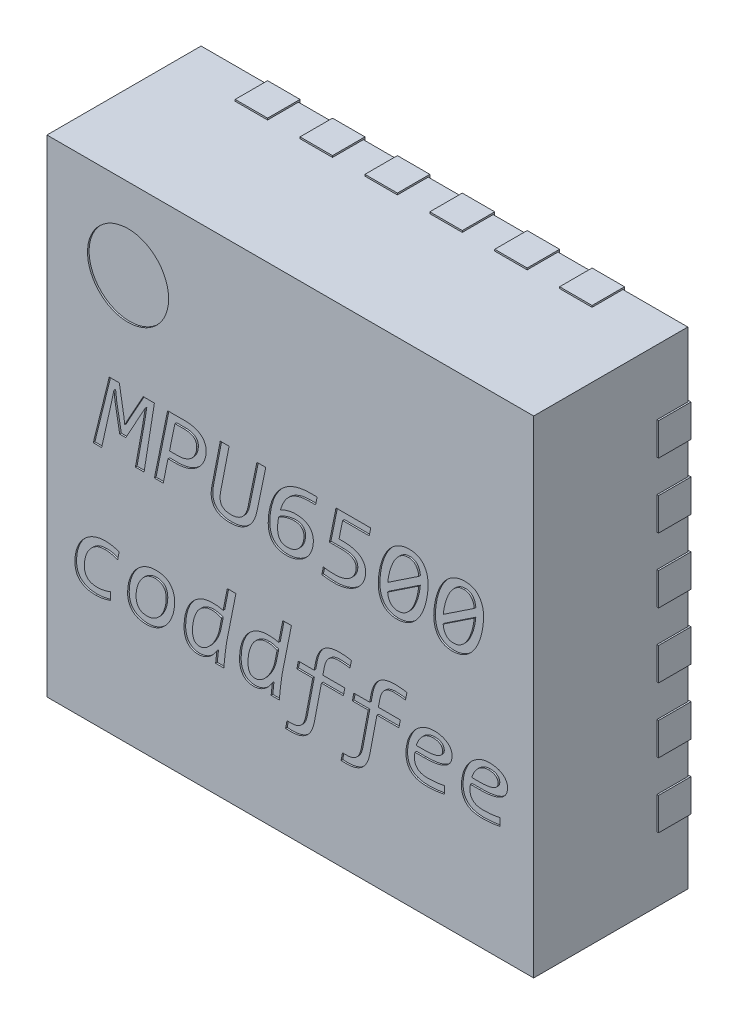
from build123d import *

# Parameters (mm, degrees)
SKETCH_1_W          = 3
SKETCH_1_H          = 3
EXTRUDE_1_DEPTH     = 0.95
EXTRUDE_2_DEPTH     = 0.2
EXTRUDE_3_DEPTH     = 0.01
SKETCH_4_R          = 0.25
CUT_EXTRUDE_1_DEPTH = 0.01


with BuildPart() as part:
    # 草图1 → 凸台-拉伸1 (new body)
    with BuildSketch(Plane.XY.offset(0.01)):
        Rectangle(SKETCH_1_W, SKETCH_1_H)
    extrude(amount=EXTRUDE_1_DEPTH)

    # 草图2 → 凸台-拉伸2 (add)
    with BuildSketch(Plane.XY):
        Polygon((0.5, 1.5), (0.5, 1.51), (0.7, 1.51), (0.7, 1.2), (0.5, 1.2), align=None)
        Polygon((0.9, 1.5), (0.9, 1.51), (1.1, 1.51), (1.1, 1.2), (0.9, 1.2), align=None)
        Polygon((0.1, 1.5), (0.1, 1.51), (0.3, 1.51), (0.3, 1.2), (0.1, 1.2), align=None)
        Polygon((-0.3, 1.5), (-0.3, 1.51), (-0.1, 1.51), (-0.1, 1.2), (-0.3, 1.2), align=None)
        Polygon((-0.7, 1.5), (-0.7, 1.51), (-0.5, 1.51), (-0.5, 1.2), (-0.7, 1.2), align=None)
        Polygon((-1.1, 1.5), (-1.1, 1.51), (-0.9, 1.51), (-0.9, 1.2), (-1.1, 1.2), align=None)
        Polygon((1.5, -0.5), (1.51, -0.5), (1.51, -0.7), (1.2, -0.7), (1.2, -0.5), align=None)
        Polygon((1.5, -0.9), (1.51, -0.9), (1.51, -1.1), (1.2, -1.1), (1.2, -0.9), align=None)
        Polygon((1.5, -0.1), (1.51, -0.1), (1.51, -0.3), (1.2, -0.3), (1.2, -0.1), align=None)
        Polygon((1.5, 0.3), (1.51, 0.3), (1.51, 0.1), (1.2, 0.1), (1.2, 0.3), align=None)
        Polygon((1.5, 0.7), (1.51, 0.7), (1.51, 0.5), (1.2, 0.5), (1.2, 0.7), align=None)
        Polygon((1.5, 1.1), (1.51, 1.1), (1.51, 0.9), (1.2, 0.9), (1.2, 1.1), align=None)
        Polygon((-0.5, -1.5), (-0.5, -1.51), (-0.7, -1.51), (-0.7, -1.2), (-0.5, -1.2), align=None)
        Polygon((-0.9, -1.5), (-0.9, -1.51), (-1.1, -1.51), (-1.1, -1.2), (-0.9, -1.2), align=None)
        Polygon((-0.1, -1.5), (-0.1, -1.51), (-0.3, -1.51), (-0.3, -1.2), (-0.1, -1.2), align=None)
        Polygon((0.3, -1.5), (0.3, -1.51), (0.1, -1.51), (0.1, -1.2), (0.3, -1.2), align=None)
        Polygon((0.7, -1.5), (0.7, -1.51), (0.5, -1.51), (0.5, -1.2), (0.7, -1.2), align=None)
        Polygon((1.1, -1.5), (1.1, -1.51), (0.9, -1.51), (0.9, -1.2), (1.1, -1.2), align=None)
        Polygon((-1.5, 0.5), (-1.51, 0.5), (-1.51, 0.7), (-1.2, 0.7), (-1.2, 0.5), align=None)
        Polygon((-1.5, 0.9), (-1.51, 0.9), (-1.51, 1.1), (-1.2, 1.1), (-1.2, 0.9), align=None)
        Polygon((-1.5, 0.1), (-1.51, 0.1), (-1.51, 0.3), (-1.2, 0.3), (-1.2, 0.1), align=None)
        Polygon((-1.5, -0.3), (-1.51, -0.3), (-1.51, -0.1), (-1.2, -0.1), (-1.2, -0.3), align=None)
        Polygon((-1.5, -0.7), (-1.51, -0.7), (-1.51, -0.5), (-1.2, -0.5), (-1.2, -0.7), align=None)
        Polygon((-1.5, -1.1), (-1.51, -1.1), (-1.51, -0.9), (-1.2, -0.9), (-1.2, -1.1), align=None)
    extrude(amount=EXTRUDE_2_DEPTH)

    # 草图3 → 凸台-拉伸3 (add)
    with BuildSketch(Plane.XY):
        with BuildLine():
            Line((-0.6, 0.77), (-0.85, 0.52))
            Line((-0.85, 0.52), (-0.85, -0.67))
            ThreePointArc((-0.85, -0.67), (-0.820710678, -0.740710678), (-0.75, -0.77))
            Line((-0.75, -0.77), (0.75, -0.77))
            ThreePointArc((0.75, -0.77), (0.820710678, -0.740710678), (0.85, -0.67))
            Line((0.85, -0.67), (0.85, 0.67))
            ThreePointArc((0.85, 0.67), (0.820710678, 0.740710678), (0.75, 0.77))
            Line((0.75, 0.77), (-0.6, 0.77))
        make_face()
    extrude(amount=EXTRUDE_3_DEPTH)

    # 草图4 → 切除-拉伸1 (cut)
    # profile 1 of 16: a face of its own
    with BuildSketch(Plane.XY.offset(0.96)):
        with Locations((-1, 1)):
            Circle(SKETCH_4_R)
    # profile 2 of 16: a face of its own
    with BuildSketch(Plane.XY.offset(0.96)):
        Polygon((-0.901449275, 0), (-0.954710145, 0), (-0.910597826, 0.243478261), (-0.894202899, 0.344655797), (-0.924003623, 0.291213768), (-1.013858696, 0.127536232), (-1.051539855, 0.127536232), (-1.080163043, 0.285054348), (-1.086865942, 0.344655797), (-1.108061594, 0.245652174), (-1.163134058, 0), (-1.214492754, 0), (-1.115942029, 0.4), (-1.053894928, 0.4), (-1.027717391, 0.245652174), (-1.020289855, 0.193568841), (-0.992572464, 0.245652174), (-0.906702899, 0.4), (-0.837681159, 0.4), align=None)
    # profile 3 of 16: a face of its own
    with BuildSketch(Plane.XY.offset(0.96)):
        with BuildLine():
            Line((-0.753894928, 0.144927536), (-0.783333333, 0))
            Line((-0.783333333, 0), (-0.837681159, 0))
            Line((-0.837681159, 0), (-0.756521739, 0.4))
            Line((-0.756521739, 0.4), (-0.647826087, 0.4))
            add(Edge.make_bspline(
                [(-0.647826087, 0.4), (-0.643386325, 0.399922338), (-0.634676657, 0.399769986), (-0.621810111, 0.398807904), (-0.609423471, 0.396945965), (-0.597483636, 0.394564459), (-0.586116536, 0.391396003), (-0.575437042, 0.387483797), (-0.565575158, 0.382580839), (-0.556384392, 0.377105074), (-0.548012523, 0.370774644), (-0.540588724, 0.36353348), (-0.534130991, 0.355442597), (-0.528666038, 0.346466093), (-0.524149191, 0.336692485), (-0.521127906, 0.325898411), (-0.519166278, 0.314262611), (-0.518951409, 0.306167979), (-0.51884058, 0.301992754)],
                knots=[0, 0, 0, 0, 1.163899976, 2.28327165, 3.379086874, 4.445466417, 5.472861667, 6.469618434, 7.42179367, 8.355667953, 9.270635804, 10.166158326, 11.067259612, 11.976733761, 12.915391941, 13.879726436, 14.906359241, 16, 16, 16, 16], degree=3))
            add(Edge.make_bspline(
                [(-0.51884058, 0.301992754), (-0.519083263, 0.295693245), (-0.519575481, 0.282916351), (-0.522987804, 0.267151126), (-0.526783745, 0.254688504), (-0.53034841, 0.245450371), (-0.534611512, 0.236461338), (-0.539404588, 0.227631506), (-0.544879639, 0.219063667), (-0.551014458, 0.210789805), (-0.55778648, 0.202740022), (-0.565148657, 0.195004662), (-0.573148885, 0.18766829), (-0.5816738, 0.180706027), (-0.590928235, 0.174420655), (-0.600747226, 0.168588072), (-0.611174763, 0.163320486), (-0.622297669, 0.158698798), (-0.63404928, 0.154667021), (-0.646391211, 0.151095106), (-0.659330972, 0.148248939), (-0.672910949, 0.146462517), (-0.68704855, 0.145064259), (-0.696705141, 0.144973717), (-0.701630435, 0.144927536)],
                knots=[0, 0, 0, 0, 1.545817738, 3.135284525, 3.942127973, 4.744940765, 5.564260606, 6.383882377, 7.210783882, 8.059085057, 8.911653302, 9.792764608, 10.679629283, 11.575959953, 12.49326948, 13.424144834, 14.37918916, 15.359686103, 16.379759377, 17.428849794, 18.51382986, 19.629589939, 20.790984809, 22, 22, 22, 22], degree=3))
            Line((-0.701630435, 0.144927536), (-0.753894928, 0.144927536))
        make_face()
        with BuildLine():
            add(Edge.make_bspline(
                [(-0.576811594, 0.29692029), (-0.576852116, 0.299128025), (-0.576930757, 0.303412647), (-0.577880298, 0.309667028), (-0.579378934, 0.315546274), (-0.581575326, 0.321010205), (-0.584346935, 0.326081795), (-0.587670535, 0.330812718), (-0.591729783, 0.335061479), (-0.596263292, 0.33901606), (-0.601466969, 0.34242794), (-0.607244729, 0.345473427), (-0.613673404, 0.347954289), (-0.620670922, 0.350038295), (-0.628271464, 0.351667822), (-0.636471446, 0.352842136), (-0.645311618, 0.3534293), (-0.651388195, 0.353557121), (-0.654528986, 0.353623188)],
                knots=[0, 0, 0, 0, 0.970227905, 1.882951801, 2.775158035, 3.633311028, 4.465274593, 5.312778446, 6.167740312, 7.043488364, 7.953212576, 8.897651525, 9.911171801, 10.978341527, 12.106168411, 13.326879335, 14.618348767, 16, 16, 16, 16], degree=3))
            Line((-0.654528986, 0.353623188), (-0.711322464, 0.353623188))
            Line((-0.711322464, 0.353623188), (-0.744474638, 0.191304348))
            Line((-0.744474638, 0.191304348), (-0.69692029, 0.191304348))
            add(Edge.make_bspline(
                [(-0.69692029, 0.191304348), (-0.693052693, 0.191335109), (-0.685545021, 0.19139482), (-0.674662496, 0.192466188), (-0.664482021, 0.193939907), (-0.655008622, 0.196125741), (-0.646211058, 0.198900594), (-0.63796077, 0.201892335), (-0.630400284, 0.205494923), (-0.621196528, 0.210582718), (-0.611065245, 0.217943632), (-0.600911547, 0.228178489), (-0.592914806, 0.239251717), (-0.586551913, 0.250788474), (-0.581969477, 0.262639685), (-0.57892824, 0.274482112), (-0.577155239, 0.285905672), (-0.57692292, 0.293352045), (-0.576811594, 0.29692029)],
                knots=[0, 0, 0, 0, 1.030063559, 1.999530639, 2.910909395, 3.769596205, 4.586447635, 5.367988662, 6.105778725, 6.815305475, 8.168639501, 9.425874683, 10.640800727, 11.796535249, 12.927503077, 14.016337836, 15.049444426, 16, 16, 16, 16], degree=3))
        make_face(mode=Mode.SUBTRACT)
    # profile 4 of 16: a face of its own
    with BuildSketch(Plane.XY.offset(0.96)):
        with BuildLine():
            add(Edge.make_bspline(
                [(-0.205253623, 0.139039855), (-0.2064865, 0.133648697), (-0.208916269, 0.123023743), (-0.213634496, 0.107608226), (-0.219242273, 0.092978216), (-0.225765896, 0.079206907), (-0.233109495, 0.066279131), (-0.241313528, 0.0542783), (-0.250567464, 0.043387561), (-0.260499462, 0.033334904), (-0.271421926, 0.024490747), (-0.283082328, 0.0165911), (-0.295664349, 0.009937636), (-0.308973317, 0.004144362), (-0.323176484, -0.000227176), (-0.338125849, -0.003553636), (-0.353906837, -0.005439201), (-0.364699292, -0.005676282), (-0.370199275, -0.005797101)],
                knots=[0, 0, 0, 0, 1.104671055, 2.177098196, 3.21785609, 4.232463178, 5.218641898, 6.185818039, 7.131996703, 8.070432256, 9.005059808, 9.935316269, 10.879935979, 11.844719911, 12.831120012, 13.844004018, 14.901274651, 16, 16, 16, 16], degree=3))
            add(Edge.make_bspline(
                [(-0.370199275, -0.005797101), (-0.376121679, -0.005676928), (-0.387482998, -0.005446392), (-0.403770819, -0.003664894), (-0.418490567, -0.000624048), (-0.431686267, 0.003583913), (-0.443307417, 0.009121967), (-0.453641756, 0.015494472), (-0.46252932, 0.023049959), (-0.470170501, 0.031483866), (-0.476225146, 0.04108317), (-0.481178558, 0.051427526), (-0.48470786, 0.062748122), (-0.486946953, 0.074912954), (-0.48785673, 0.087875878), (-0.487771251, 0.101566236), (-0.486479088, 0.115979411), (-0.484820433, 0.125764606), (-0.483967391, 0.130797101)],
                knots=[0, 0, 0, 0, 1.331872091, 2.555013774, 3.679113731, 4.707778063, 5.66163268, 6.567911039, 7.430466873, 8.276967353, 9.117097013, 9.973724558, 10.849992188, 11.775679245, 12.749651972, 13.768315038, 14.85225142, 16, 16, 16, 16], degree=3))
            Line((-0.483967391, 0.130797101), (-0.431884058, 0.4))
            Line((-0.431884058, 0.4), (-0.377536232, 0.4))
            Line((-0.377536232, 0.4), (-0.428894928, 0.135054348))
            add(Edge.make_bspline(
                [(-0.428894928, 0.135054348), (-0.429568772, 0.131255934), (-0.430864217, 0.123953595), (-0.432102212, 0.113276308), (-0.432905229, 0.103366244), (-0.43291804, 0.094157673), (-0.432241836, 0.085689109), (-0.430738807, 0.077878986), (-0.428273527, 0.07083393), (-0.425122813, 0.064396453), (-0.420869007, 0.058852195), (-0.415789763, 0.053939878), (-0.409793621, 0.049787393), (-0.402855281, 0.046405261), (-0.3949381, 0.043769432), (-0.385996472, 0.041955285), (-0.37599984, 0.040726441), (-0.368995724, 0.040630319), (-0.365307971, 0.04057971)],
                knots=[0, 0, 0, 0, 1.32934195, 2.555621527, 3.703391236, 4.754476451, 5.72588162, 6.627976357, 7.486961688, 8.292126728, 9.087207773, 9.882084471, 10.719297171, 11.58961798, 12.534116074, 13.587311439, 14.729690086, 16, 16, 16, 16], degree=3))
            add(Edge.make_bspline(
                [(-0.365307971, 0.04057971), (-0.361801888, 0.040638507), (-0.354919923, 0.040753917), (-0.344895165, 0.041973029), (-0.335367732, 0.043851497), (-0.32637785, 0.046560165), (-0.3179218, 0.050110419), (-0.309994052, 0.054416416), (-0.302510411, 0.059351184), (-0.295711117, 0.065259687), (-0.289354038, 0.071732933), (-0.283653165, 0.078989316), (-0.278340495, 0.086788274), (-0.27368898, 0.09531307), (-0.269468306, 0.104436537), (-0.265867253, 0.114257635), (-0.262790146, 0.124731119), (-0.261216973, 0.131993751), (-0.260416667, 0.135688406)],
                knots=[0, 0, 0, 0, 1.080749632, 2.121365103, 3.109281951, 4.072492524, 5.01150105, 5.932234828, 6.851602216, 7.769648402, 8.704678256, 9.645531594, 10.61139385, 11.611651689, 12.636568676, 13.708942775, 14.834490439, 16, 16, 16, 16], degree=3))
            Line((-0.260416667, 0.135688406), (-0.205797101, 0.4))
            Line((-0.205797101, 0.4), (-0.151086957, 0.4))
            Line((-0.151086957, 0.4), (-0.205253623, 0.139039855))
        make_face()
    # profile 5 of 16: a face of its own
    with BuildSketch(Plane.XY.offset(0.96)):
        with BuildLine():
            add(Edge.make_bspline(
                [(0.142028986, 0.152264493), (0.141859752, 0.146973087), (0.14152457, 0.136493031), (0.139221469, 0.12096832), (0.135312473, 0.105885082), (0.129841409, 0.091317896), (0.123116923, 0.077383187), (0.11494724, 0.064367019), (0.105705136, 0.052149987), (0.095188944, 0.040932345), (0.083499448, 0.030720653), (0.07073975, 0.021569043), (0.056812908, 0.013574149), (0.041983934, 0.006593357), (0.026145914, 0.00105128), (0.009520841, -0.00292996), (-0.007901181, -0.00532794), (-0.019768965, -0.005638753), (-0.025815217, -0.005797101)],
                knots=[0, 0, 0, 0, 0.988928225, 1.958652132, 2.926403384, 3.8960616, 4.862759122, 5.813326307, 6.763725946, 7.722001776, 8.681871633, 9.660699901, 10.65191214, 11.67950509, 12.720080233, 13.782284591, 14.870145749, 16, 16, 16, 16], degree=3))
            add(Edge.make_bspline(
                [(-0.025815217, -0.005797101), (-0.030136791, -0.005716304), (-0.038530755, -0.005559369), (-0.050739183, -0.004168653), (-0.062177845, -0.00194933), (-0.072851702, 0.001246171), (-0.08280109, 0.005273159), (-0.09188356, 0.010431261), (-0.10029335, 0.016303633), (-0.107887974, 0.023162816), (-0.114605455, 0.030987898), (-0.120455344, 0.03977195), (-0.125359686, 0.049542552), (-0.129301385, 0.060317619), (-0.132520127, 0.072029983), (-0.134578039, 0.084755802), (-0.136005941, 0.098397552), (-0.136154925, 0.107815959), (-0.136231884, 0.112681159)],
                knots=[0, 0, 0, 0, 1.118030818, 2.171595754, 3.175304151, 4.129526303, 5.050937611, 5.946475562, 6.826644675, 7.700723301, 8.587216566, 9.488733896, 10.425228416, 11.409248623, 12.453646764, 13.563511262, 14.741400276, 16, 16, 16, 16], degree=3))
            add(Edge.make_bspline(
                [(-0.136231884, 0.112681159), (-0.13609563, 0.118510137), (-0.135805134, 0.130937664), (-0.134375908, 0.150574138), (-0.131550858, 0.171955475), (-0.127344379, 0.19463799), (-0.121367783, 0.218138518), (-0.11355321, 0.242125914), (-0.103522153, 0.266048485), (-0.093024197, 0.285357714), (-0.083402227, 0.300302313), (-0.075441824, 0.311269614), (-0.066714535, 0.321842137), (-0.057397424, 0.332145851), (-0.04723208, 0.341921265), (-0.036299432, 0.351189238), (-0.024451501, 0.359696977), (-0.011836996, 0.367620921), (0.001684245, 0.374790101), (0.016174112, 0.381121793), (0.031527978, 0.386735573), (0.047866192, 0.391467974), (0.065201148, 0.395261584), (0.083589003, 0.398075131), (0.103050127, 0.399701515), (0.116361666, 0.399898816), (0.123188406, 0.4)],
                knots=[0, 0, 0, 0, 0.960589345, 2.04800045, 3.241990704, 4.512353572, 5.846809385, 7.234343732, 8.665557632, 10.114711593, 10.848819235, 11.593121328, 12.346018801, 13.106650409, 13.88066678, 14.667950388, 15.46602081, 16.281787734, 17.12076609, 17.985012341, 18.885207259, 19.812499977, 20.785377173, 21.806957431, 22.875311825, 24, 24, 24, 24], degree=3))
            Line((0.123188406, 0.4), (0.165217391, 0.4))
            Line((0.165217391, 0.4), (0.155978261, 0.353623188))
            Line((0.155978261, 0.353623188), (0.114764493, 0.353623188))
            add(Edge.make_bspline(
                [(0.114764493, 0.353623188), (0.108207817, 0.3535092), (0.095548025, 0.353289108), (0.077243932, 0.351388479), (0.06037814, 0.34818909), (0.04492896, 0.343621796), (0.030815939, 0.337944164), (0.017761963, 0.331453615), (0.00588618, 0.323888341), (-0.004966248, 0.31554911), (-0.014719965, 0.306308944), (-0.023482541, 0.296345828), (-0.03139023, 0.285696821), (-0.038060376, 0.274224343), (-0.044148809, 0.262402668), (-0.049437567, 0.250153807), (-0.054444513, 0.237712585), (-0.057094252, 0.229127106), (-0.058423913, 0.224818841)],
                knots=[0, 0, 0, 0, 1.339125786, 2.585617217, 3.754133118, 4.841168083, 5.870834361, 6.858330749, 7.814849168, 8.742597304, 9.650135155, 10.554712917, 11.450330476, 12.354739998, 13.262277849, 14.165340333, 15.079352475, 16, 16, 16, 16], degree=3))
            Line((-0.058423913, 0.224818841), (-0.060869565, 0.219202899))
            add(Edge.make_bspline(
                [(-0.060869565, 0.219202899), (-0.053440816, 0.222581068), (-0.038462462, 0.229392364), (-0.018783912, 0.235675036), (-0.002684598, 0.239719443), (0.009538677, 0.241896161), (0.021831688, 0.243194579), (0.030039227, 0.243383615), (0.034148551, 0.243478261)],
                knots=[0, 0, 0, 0, 1.484699281, 2.993552595, 3.752143111, 4.505858521, 5.251918119, 6, 6, 6, 6], degree=3))
            add(Edge.make_bspline(
                [(0.034148551, 0.243478261), (0.038648818, 0.243375692), (0.047363269, 0.243177073), (0.059984806, 0.24209883), (0.071625685, 0.239858034), (0.082362895, 0.236998353), (0.092197952, 0.233379028), (0.101141167, 0.229037516), (0.109146181, 0.223939743), (0.11628426, 0.218221692), (0.1224576, 0.211813354), (0.127880248, 0.20490763), (0.132332498, 0.197342832), (0.135823828, 0.189213804), (0.138671586, 0.180678674), (0.140650554, 0.171632893), (0.141850545, 0.16211009), (0.141968726, 0.155589362), (0.142028986, 0.152264493)],
                knots=[0, 0, 0, 0, 1.344857572, 2.604222392, 3.779007849, 4.881910503, 5.920832387, 6.90521753, 7.846153531, 8.750622099, 9.630972023, 10.498894168, 11.368361951, 12.244913851, 13.137791994, 14.052637556, 15.007054825, 16, 16, 16, 16], degree=3))
        make_face()
        with BuildLine():
            add(Edge.make_bspline(
                [(0.084057971, 0.149637681), (0.083911431, 0.153671655), (0.083631907, 0.16136643), (0.080784438, 0.172168887), (0.076074444, 0.181510223), (0.070627553, 0.188048529), (0.06542328, 0.192430181), (0.0609383, 0.195252994), (0.055895436, 0.197579538), (0.050400603, 0.199604713), (0.044335167, 0.201002763), (0.037800694, 0.202074611), (0.030724838, 0.202854664), (0.025817479, 0.202883589), (0.023278986, 0.202898551)],
                knots=[0, 0, 0, 0, 1.56835142, 2.991618572, 4.311606987, 5.613931137, 6.273375164, 6.955190034, 7.670554158, 8.43307306, 9.231641722, 10.08996269, 11.01197038, 12, 12, 12, 12], degree=3))
            add(Edge.make_bspline(
                [(0.023278986, 0.202898551), (0.019166072, 0.202801445), (0.010814553, 0.202604266), (-0.001732041, 0.200727643), (-0.014328011, 0.19817757), (-0.026707741, 0.194638924), (-0.038885031, 0.190743565), (-0.050481104, 0.186025467), (-0.061434173, 0.181048957), (-0.068258327, 0.177276819), (-0.071557971, 0.175452899)],
                knots=[0, 0, 0, 0, 0.989354276, 2.008943657, 3.048006366, 4.081257945, 5.106272222, 6.123839275, 7.092830682, 8, 8, 8, 8], degree=3))
            add(Edge.make_bspline(
                [(-0.071557971, 0.175452899), (-0.072668007, 0.170637162), (-0.074975841, 0.160624947), (-0.076851659, 0.144998229), (-0.078061749, 0.128944993), (-0.078195047, 0.118178683), (-0.07826087, 0.112862319)],
                knots=[0, 0, 0, 0, 0.939273768, 1.952808201, 2.989104178, 4, 4, 4, 4], degree=3))
            add(Edge.make_bspline(
                [(-0.07826087, 0.112862319), (-0.078205518, 0.109539676), (-0.078099704, 0.103187925), (-0.077392326, 0.094077993), (-0.076174875, 0.085827891), (-0.074325349, 0.078418514), (-0.072114618, 0.071738088), (-0.069274023, 0.065848523), (-0.066093431, 0.060599911), (-0.062476212, 0.056026208), (-0.058304573, 0.052142945), (-0.053668036, 0.048920609), (-0.048658041, 0.04613258), (-0.04113226, 0.043341919), (-0.030567028, 0.041027073), (-0.021753501, 0.040733869), (-0.017119565, 0.04057971)],
                knots=[0, 0, 0, 0, 1.274816234, 2.437010584, 3.503642409, 4.470203397, 5.364121765, 6.198397672, 6.973290133, 7.715087648, 8.42819637, 9.151396755, 9.877190593, 10.621606915, 12.22372369, 14, 14, 14, 14], degree=3))
            add(Edge.make_bspline(
                [(-0.017119565, 0.04057971), (-0.013306834, 0.040663005), (-0.00581701, 0.040826633), (0.005079559, 0.04273774), (0.015433899, 0.04560036), (0.025139853, 0.049714479), (0.034167154, 0.054807505), (0.042553262, 0.060614938), (0.050200801, 0.067171588), (0.057127677, 0.074451592), (0.06325495, 0.082444881), (0.06870742, 0.090947332), (0.073346272, 0.099997749), (0.077229603, 0.109480825), (0.080296319, 0.119299377), (0.082479175, 0.129300407), (0.083777685, 0.139428275), (0.083964202, 0.146222153), (0.084057971, 0.149637681)],
                knots=[0, 0, 0, 0, 1.103915528, 2.168559294, 3.196345596, 4.21217722, 5.215186676, 6.195959169, 7.164157136, 8.129820549, 9.103067822, 10.078986914, 11.053571012, 12.046527482, 13.045750178, 14.031041307, 15.010133491, 16, 16, 16, 16], degree=3))
        make_face(mode=Mode.SUBTRACT)
    # profile 6 of 16: a face of its own
    with BuildSketch(Plane.XY.offset(0.96)):
        with BuildLine():
            add(Edge.make_bspline(
                [(0.464039855, 0.148550725), (0.463871006, 0.143254763), (0.463536819, 0.132772919), (0.460700567, 0.117324186), (0.456178371, 0.102386342), (0.449799961, 0.088053627), (0.441770505, 0.074485054), (0.432458775, 0.061655593), (0.421631132, 0.049803486), (0.409525977, 0.038843367), (0.396060056, 0.029010501), (0.381503531, 0.020115517), (0.365630029, 0.012589594), (0.348757651, 0.005924739), (0.330805109, 0.000704714), (0.312025677, -0.003091315), (0.292420025, -0.005422894), (0.279082605, -0.005670739), (0.272282609, -0.005797101)],
                knots=[0, 0, 0, 0, 0.928717278, 1.838130619, 2.746540185, 3.662152379, 4.583571444, 5.508730259, 6.438942558, 7.39553379, 8.369400545, 9.360751507, 10.384464482, 11.448066924, 12.541215522, 13.66031397, 14.807126362, 16, 16, 16, 16], degree=3))
            add(Edge.make_bspline(
                [(0.272282609, -0.005797101), (0.268870425, -0.005786386), (0.261953525, -0.005764666), (0.251505631, -0.005368913), (0.241030171, -0.004815693), (0.230699287, -0.00421052), (0.220702238, -0.003401067), (0.211187857, -0.002417878), (0.202387223, -0.001299792), (0.196826262, -0.000293537), (0.194202899, 0.000181159)],
                knots=[0, 0, 0, 0, 1.044502813, 2.117331066, 3.200186155, 4.255875667, 5.285218462, 6.27024057, 7.183992095, 8, 8, 8, 8], degree=3))
            Line((0.194202899, 0.000181159), (0.203351449, 0.046376812))
            add(Edge.make_bspline(
                [(0.203351449, 0.046376812), (0.206096132, 0.045876639), (0.211781527, 0.04484057), (0.220601578, 0.043582627), (0.229822767, 0.042636604), (0.23927398, 0.041814229), (0.248784956, 0.041163535), (0.25830086, 0.04082425), (0.267602073, 0.040658079), (0.27373183, 0.040605399), (0.276721014, 0.04057971)],
                knots=[0, 0, 0, 0, 0.908406311, 1.881692453, 2.900113492, 3.926429204, 4.970856668, 6.003931323, 7.026614548, 8, 8, 8, 8], degree=3))
            add(Edge.make_bspline(
                [(0.276721014, 0.04057971), (0.281374366, 0.040658383), (0.290523458, 0.040813063), (0.303917274, 0.042273518), (0.31668796, 0.044747601), (0.328821655, 0.048057954), (0.340269278, 0.052330906), (0.35091571, 0.057396386), (0.360826843, 0.06309737), (0.369776093, 0.069671232), (0.377975833, 0.076782478), (0.385151724, 0.08461082), (0.391369277, 0.09302404), (0.396634632, 0.101963594), (0.400809029, 0.111451179), (0.403950327, 0.12129963), (0.405660757, 0.131583379), (0.405931786, 0.138520845), (0.406068841, 0.142028986)],
                knots=[0, 0, 0, 0, 1.220166707, 2.399005841, 3.528093536, 4.628946758, 5.693896036, 6.728226176, 7.71835301, 8.687741905, 9.636071676, 10.560831783, 11.466786123, 12.375401534, 13.275940511, 14.180128012, 15.079726406, 16, 16, 16, 16], degree=3))
            add(Edge.make_bspline(
                [(0.406068841, 0.142028986), (0.405996047, 0.144236919), (0.405854667, 0.148525172), (0.404848579, 0.154765957), (0.403147217, 0.160596296), (0.400668126, 0.165973072), (0.397549026, 0.17095062), (0.393726312, 0.175479475), (0.389210693, 0.179602411), (0.38402401, 0.183330138), (0.378086613, 0.186589898), (0.371393776, 0.189390422), (0.36400181, 0.191801105), (0.355841078, 0.193847727), (0.346915953, 0.195191267), (0.337248751, 0.196284129), (0.326854001, 0.197055045), (0.319657255, 0.19708565), (0.315942029, 0.197101449)],
                knots=[0, 0, 0, 0, 0.888619011, 1.725878067, 2.537330492, 3.325977742, 4.101591725, 4.895280693, 5.703906225, 6.557330919, 7.460461648, 8.424439527, 9.47375797, 10.588079712, 11.807001866, 13.103622345, 14.504782878, 16, 16, 16, 16], degree=3))
            Line((0.315942029, 0.197101449), (0.24057971, 0.197101449))
            Line((0.24057971, 0.197101449), (0.281612319, 0.4))
            Line((0.281612319, 0.4), (0.495652174, 0.4))
            Line((0.495652174, 0.4), (0.486231884, 0.353623188))
            Line((0.486231884, 0.353623188), (0.322554348, 0.353623188))
            Line((0.322554348, 0.353623188), (0.300271739, 0.243478261))
            Line((0.300271739, 0.243478261), (0.331793478, 0.243478261))
            add(Edge.make_bspline(
                [(0.331793478, 0.243478261), (0.336232689, 0.243391372), (0.344969147, 0.243220372), (0.357926802, 0.242381918), (0.370456031, 0.240584124), (0.382632606, 0.238377126), (0.39426195, 0.235461756), (0.405185507, 0.231623453), (0.41536681, 0.22708625), (0.424841064, 0.22188888), (0.433400789, 0.215737621), (0.441204464, 0.208913295), (0.447799122, 0.200954892), (0.453705035, 0.192381902), (0.458361209, 0.182742156), (0.461697424, 0.172163181), (0.463726634, 0.16064516), (0.46393329, 0.152665537), (0.464039855, 0.148550725)],
                knots=[0, 0, 0, 0, 1.160525095, 2.283937116, 3.391098912, 4.466848082, 5.51767417, 6.521020575, 7.488982201, 8.428737089, 9.339719699, 10.239558793, 11.129795246, 12.033777585, 12.954991884, 13.915882227, 14.925293447, 16, 16, 16, 16], degree=3))
        make_face()
    # profile 7 of 16: a face of its own
    with BuildSketch(Plane.XY.offset(0.96)):
        with BuildLine():
            add(Edge.make_bspline(
                [(0.655978261, -0.005797101), (0.651777823, -0.005680482), (0.643563023, -0.005452409), (0.631511903, -0.004024302), (0.620058054, -0.00145644), (0.609159942, 0.002026511), (0.598955412, 0.006645123), (0.589568472, 0.012422577), (0.580883946, 0.019168161), (0.572962693, 0.026974845), (0.565927303, 0.035968149), (0.559832307, 0.046047461), (0.554421084, 0.057125911), (0.549898029, 0.069279783), (0.546402532, 0.082542682), (0.54388182, 0.096872141), (0.542336749, 0.112285119), (0.54213373, 0.122943143), (0.542028986, 0.128442029)],
                knots=[0, 0, 0, 0, 1.007320364, 1.970017588, 2.90453218, 3.818085205, 4.709096538, 5.583269886, 6.455131516, 7.340832138, 8.243184708, 9.185658703, 10.160315356, 11.195836441, 12.289964397, 13.444606486, 14.681573724, 16, 16, 16, 16], degree=3))
            add(Edge.make_bspline(
                [(0.542028986, 0.128442029), (0.542163076, 0.134029765), (0.542449015, 0.145945277), (0.543917469, 0.164756231), (0.546564694, 0.18524663), (0.550319399, 0.20700209), (0.555513857, 0.229617667), (0.562008602, 0.252788888), (0.570254792, 0.275852416), (0.580203278, 0.298361834), (0.592069401, 0.319797386), (0.60343721, 0.336740041), (0.613544638, 0.349394943), (0.621620167, 0.358354863), (0.630348604, 0.366576469), (0.639586909, 0.374244858), (0.649486988, 0.381114092), (0.659932393, 0.387285799), (0.67090446, 0.392751457), (0.682479928, 0.397357898), (0.694659724, 0.401296262), (0.707621274, 0.403780703), (0.721239155, 0.405521326), (0.730549577, 0.405703593), (0.735326087, 0.405797101)],
                knots=[0, 0, 0, 0, 0.983508977, 2.097273836, 3.318505522, 4.618352553, 5.980809812, 7.400391859, 8.850813716, 10.287505912, 11.726367946, 13.157359761, 13.871838869, 14.575246903, 15.278092789, 15.980195145, 16.686247279, 17.396127794, 18.113761176, 18.840950007, 19.587109667, 20.362403165, 21.159866475, 22, 22, 22, 22], degree=3))
            add(Edge.make_bspline(
                [(0.735326087, 0.405797101), (0.739526029, 0.405678016), (0.747739862, 0.405445121), (0.759804561, 0.404050851), (0.771211491, 0.40136131), (0.782056615, 0.397850087), (0.792298349, 0.39335231), (0.801710568, 0.387590051), (0.810455921, 0.38086621), (0.818213865, 0.372873793), (0.825367909, 0.363995106), (0.831491527, 0.353932104), (0.836878785, 0.342872956), (0.841416201, 0.330721963), (0.844865556, 0.317445849), (0.847576353, 0.303145272), (0.848925099, 0.287707021), (0.849156131, 0.277055175), (0.849275362, 0.271557971)],
                knots=[0, 0, 0, 0, 1.007519252, 1.970406553, 2.906703269, 3.813552425, 4.701763106, 5.582294801, 6.454328573, 7.34020407, 8.247226692, 9.183719418, 10.15856851, 11.194294051, 12.288638035, 13.444801513, 14.681313411, 16, 16, 16, 16], degree=3))
            add(Edge.make_bspline(
                [(0.849275362, 0.271557971), (0.849186027, 0.265969431), (0.848994508, 0.253988615), (0.84734742, 0.235098261), (0.844763246, 0.214509093), (0.840970083, 0.192729569), (0.835837351, 0.170118644), (0.829165002, 0.14709086), (0.8210459, 0.124034634), (0.81101815, 0.101632418), (0.799203799, 0.080146511), (0.787879855, 0.063192019), (0.777785702, 0.050521283), (0.769651711, 0.041612978), (0.76087312, 0.033446855), (0.751639145, 0.025781101), (0.741804243, 0.018863214), (0.731354534, 0.012684929), (0.720282815, 0.007281935), (0.708682658, 0.002496438), (0.696404523, -0.001230883), (0.683478256, -0.003805099), (0.66994249, -0.005508111), (0.660693736, -0.005699515), (0.655978261, -0.005797101)],
                knots=[0, 0, 0, 0, 0.983358193, 2.108141662, 3.334653408, 4.634509843, 5.996976958, 7.412925025, 8.851561986, 10.295282677, 11.726935779, 13.162340783, 13.87682506, 14.57631381, 15.283030534, 15.98513797, 16.686843167, 17.396728818, 18.119131638, 18.853242527, 19.602918259, 20.373010585, 21.170479664, 22, 22, 22, 22], degree=3))
        make_face()
        with BuildLine():
            add(Edge.make_bspline(
                [(0.663949275, 0.04057971), (0.667246761, 0.040681892), (0.67373242, 0.040882867), (0.683269653, 0.042545349), (0.692338615, 0.04538867), (0.701032233, 0.049218027), (0.709218291, 0.054065786), (0.717086197, 0.059583804), (0.724381181, 0.066001583), (0.73141611, 0.072956139), (0.737910329, 0.080714957), (0.744077194, 0.089065409), (0.749897728, 0.09802752), (0.756972986, 0.110940738), (0.765087765, 0.127883979), (0.77325946, 0.149169688), (0.780129064, 0.171145312), (0.785086504, 0.193609939), (0.789088755, 0.215781242), (0.79057916, 0.230513081), (0.791304348, 0.237681159)],
                knots=[0, 0, 0, 0, 0.697985219, 1.372832266, 2.04223556, 2.706365949, 3.379696825, 4.053846856, 4.738347739, 5.434602983, 6.146850836, 6.878325688, 7.632068676, 8.407730472, 9.994965438, 11.606242171, 13.232268665, 14.865519972, 16.474854573, 18, 18, 18, 18], degree=3))
            Line((0.791304348, 0.237681159), (0.6, 0.110144928))
            add(Edge.make_bspline(
                [(0.6, 0.110144928), (0.600631793, 0.105239036), (0.601848377, 0.095792215), (0.605111185, 0.082324653), (0.610057486, 0.070333851), (0.615693987, 0.061569732), (0.621223282, 0.055726006), (0.625757342, 0.051766997), (0.630850365, 0.048459782), (0.636354599, 0.04559206), (0.642394414, 0.043310469), (0.649048982, 0.041673785), (0.656318723, 0.040823279), (0.66135072, 0.040662657), (0.663949275, 0.04057971)],
                knots=[0, 0, 0, 0, 1.67889269, 3.232887858, 4.689415349, 6.065581733, 6.740090105, 7.416154797, 8.104237989, 8.796584627, 9.520106762, 10.290891389, 11.117405419, 12, 12, 12, 12], degree=3))
        make_face(mode=Mode.SUBTRACT)
        with BuildLine():
            add(Edge.make_bspline(
                [(0.72798913, 0.35942029), (0.724690571, 0.359322456), (0.71823257, 0.359130915), (0.70877675, 0.357424713), (0.699758852, 0.354732328), (0.691226767, 0.350864271), (0.68313166, 0.34614155), (0.675507083, 0.340522839), (0.668154851, 0.334314308), (0.661281652, 0.327308803), (0.654817751, 0.319615599), (0.648687362, 0.311338279), (0.64295012, 0.302358256), (0.635722273, 0.289575799), (0.627788846, 0.272507259), (0.6195453, 0.251204103), (0.612808512, 0.229043831), (0.607336184, 0.20657359), (0.603273768, 0.184267621), (0.601499491, 0.169514782), (0.600634058, 0.162318841)],
                knots=[0, 0, 0, 0, 0.699105571, 1.36872642, 2.031204443, 2.690548697, 3.350670022, 4.015496388, 4.69692579, 5.389785013, 6.094150606, 6.826799565, 7.57289987, 8.352941364, 9.939974205, 11.559810885, 13.194567727, 14.848789836, 16.462945086, 18, 18, 18, 18], degree=3))
            Line((0.600634058, 0.162318841), (0.791938406, 0.289855072))
            add(Edge.make_bspline(
                [(0.791938406, 0.289855072), (0.791246634, 0.294741486), (0.789905841, 0.304212348), (0.785936803, 0.317557222), (0.780835061, 0.32957349), (0.77496616, 0.338234711), (0.769455056, 0.344065624), (0.76501126, 0.34805695), (0.759960674, 0.351363922), (0.75454644, 0.354324526), (0.748584465, 0.356537329), (0.742215554, 0.358355435), (0.735255845, 0.359168541), (0.730466103, 0.359334477), (0.72798913, 0.35942029)],
                knots=[0, 0, 0, 0, 1.688192296, 3.272059616, 4.753604763, 6.144763221, 6.8251676, 7.499335038, 8.184828526, 8.888033964, 9.608219138, 10.358298917, 11.151008669, 12, 12, 12, 12], degree=3))
        make_face(mode=Mode.SUBTRACT)
    # profile 8 of 16: a face of its own
    with BuildSketch(Plane.XY.offset(0.96)):
        with BuildLine():
            add(Edge.make_bspline(
                [(0.998007246, -0.005797101), (0.993806809, -0.005680482), (0.985592008, -0.005452409), (0.973540889, -0.004024302), (0.962087039, -0.00145644), (0.951188928, 0.002026511), (0.940984397, 0.006645123), (0.931597458, 0.012422577), (0.922912931, 0.019168161), (0.914991679, 0.026974845), (0.907956289, 0.035968149), (0.901861293, 0.046047461), (0.896450069, 0.057125911), (0.891927015, 0.069279783), (0.888431518, 0.082542682), (0.885910805, 0.096872141), (0.884365734, 0.112285119), (0.884162716, 0.122943143), (0.884057971, 0.128442029)],
                knots=[0, 0, 0, 0, 1.007320364, 1.970017588, 2.90453218, 3.818085205, 4.709096538, 5.583269886, 6.455131516, 7.340832138, 8.243184708, 9.185658703, 10.160315356, 11.195836441, 12.289964397, 13.444606486, 14.681573724, 16, 16, 16, 16], degree=3))
            add(Edge.make_bspline(
                [(0.884057971, 0.128442029), (0.884192061, 0.134029765), (0.884478, 0.145945277), (0.885946454, 0.164756231), (0.88859368, 0.18524663), (0.892348385, 0.20700209), (0.897542842, 0.229617667), (0.904037587, 0.252788888), (0.912283778, 0.275852416), (0.922232263, 0.298361834), (0.934098386, 0.319797386), (0.945466196, 0.336740041), (0.955573623, 0.349394943), (0.963649152, 0.358354863), (0.972377589, 0.366576469), (0.981615895, 0.374244858), (0.991515973, 0.381114092), (1.001961378, 0.387285799), (1.012933446, 0.392751457), (1.024508914, 0.397357898), (1.036688709, 0.401296262), (1.04965026, 0.403780703), (1.06326814, 0.405521326), (1.072578562, 0.405703593), (1.077355072, 0.405797101)],
                knots=[0, 0, 0, 0, 0.983508977, 2.097273836, 3.318505522, 4.618352553, 5.980809812, 7.400391859, 8.850813716, 10.287505912, 11.726367946, 13.157359761, 13.871838869, 14.575246903, 15.278092789, 15.980195145, 16.686247279, 17.396127794, 18.113761176, 18.840950007, 19.587109667, 20.362403165, 21.159866475, 22, 22, 22, 22], degree=3))
            add(Edge.make_bspline(
                [(1.077355072, 0.405797101), (1.081555015, 0.405678016), (1.089768847, 0.405445121), (1.101833547, 0.404050851), (1.113240477, 0.40136131), (1.1240856, 0.397850087), (1.134327334, 0.39335231), (1.143739553, 0.387590051), (1.152484906, 0.38086621), (1.160242851, 0.372873793), (1.167396895, 0.363995106), (1.173520513, 0.353932104), (1.17890777, 0.342872956), (1.183445187, 0.330721963), (1.186894542, 0.317445849), (1.189605338, 0.303145272), (1.190954085, 0.287707021), (1.191185117, 0.277055175), (1.191304348, 0.271557971)],
                knots=[0, 0, 0, 0, 1.007519252, 1.970406553, 2.906703269, 3.813552425, 4.701763106, 5.582294801, 6.454328573, 7.34020407, 8.247226692, 9.183719418, 10.15856851, 11.194294051, 12.288638035, 13.444801513, 14.681313411, 16, 16, 16, 16], degree=3))
            add(Edge.make_bspline(
                [(1.191304348, 0.271557971), (1.191215012, 0.265969431), (1.191023493, 0.253988615), (1.189376406, 0.235098261), (1.186792231, 0.214509093), (1.182999069, 0.192729569), (1.177866336, 0.170118644), (1.171193987, 0.14709086), (1.163074886, 0.124034634), (1.153047136, 0.101632418), (1.141232784, 0.080146511), (1.129908841, 0.063192019), (1.119814687, 0.050521283), (1.111680696, 0.041612978), (1.102902106, 0.033446855), (1.093668131, 0.025781101), (1.083833228, 0.018863214), (1.073383519, 0.012684929), (1.0623118, 0.007281935), (1.050711644, 0.002496438), (1.038433509, -0.001230883), (1.025507241, -0.003805099), (1.011971475, -0.005508111), (1.002722722, -0.005699515), (0.998007246, -0.005797101)],
                knots=[0, 0, 0, 0, 0.983358193, 2.108141662, 3.334653408, 4.634509843, 5.996976958, 7.412925025, 8.851561986, 10.295282677, 11.726935779, 13.162340783, 13.87682506, 14.57631381, 15.283030534, 15.98513797, 16.686843167, 17.396728818, 18.119131638, 18.853242527, 19.602918259, 20.373010585, 21.170479664, 22, 22, 22, 22], degree=3))
        make_face()
        with BuildLine():
            add(Edge.make_bspline(
                [(1.005978261, 0.04057971), (1.009275746, 0.040681892), (1.015761406, 0.040882867), (1.025298639, 0.042545349), (1.0343676, 0.04538867), (1.043061218, 0.049218027), (1.051247276, 0.054065786), (1.059115183, 0.059583804), (1.066410166, 0.066001583), (1.073445095, 0.072956139), (1.079939314, 0.080714957), (1.086106179, 0.089065409), (1.091926714, 0.09802752), (1.099001972, 0.110940738), (1.107116751, 0.127883979), (1.115288446, 0.149169688), (1.12215805, 0.171145312), (1.12711549, 0.193609939), (1.13111774, 0.215781242), (1.132608146, 0.230513081), (1.133333333, 0.237681159)],
                knots=[0, 0, 0, 0, 0.697985219, 1.372832266, 2.04223556, 2.706365949, 3.379696825, 4.053846856, 4.738347739, 5.434602983, 6.146850836, 6.878325688, 7.632068676, 8.407730472, 9.994965438, 11.606242171, 13.232268665, 14.865519972, 16.474854573, 18, 18, 18, 18], degree=3))
            Line((1.133333333, 0.237681159), (0.942028986, 0.110144928))
            add(Edge.make_bspline(
                [(0.942028986, 0.110144928), (0.942660778, 0.105239036), (0.943877362, 0.095792215), (0.947140171, 0.082324653), (0.952086472, 0.070333851), (0.957722973, 0.061569732), (0.963252267, 0.055726006), (0.967786327, 0.051766997), (0.972879351, 0.048459782), (0.978383585, 0.04559206), (0.984423399, 0.043310469), (0.991077967, 0.041673785), (0.998347708, 0.040823279), (1.003379705, 0.040662657), (1.005978261, 0.04057971)],
                knots=[0, 0, 0, 0, 1.67889269, 3.232887858, 4.689415349, 6.065581733, 6.740090105, 7.416154797, 8.104237989, 8.796584627, 9.520106762, 10.290891389, 11.117405419, 12, 12, 12, 12], degree=3))
        make_face(mode=Mode.SUBTRACT)
        with BuildLine():
            add(Edge.make_bspline(
                [(1.070018116, 0.35942029), (1.066719557, 0.359322456), (1.060261555, 0.359130915), (1.050805736, 0.357424713), (1.041787838, 0.354732328), (1.033255752, 0.350864271), (1.025160645, 0.34614155), (1.017536068, 0.340522839), (1.010183837, 0.334314308), (1.003310637, 0.327308803), (0.996846736, 0.319615599), (0.990716347, 0.311338279), (0.984979105, 0.302358256), (0.977751258, 0.289575799), (0.969817832, 0.272507259), (0.961574286, 0.251204103), (0.954837497, 0.229043831), (0.949365169, 0.20657359), (0.945302753, 0.184267621), (0.943528476, 0.169514782), (0.942663043, 0.162318841)],
                knots=[0, 0, 0, 0, 0.699105571, 1.36872642, 2.031204443, 2.690548697, 3.350670022, 4.015496388, 4.69692579, 5.389785013, 6.094150606, 6.826799565, 7.57289987, 8.352941364, 9.939974205, 11.559810885, 13.194567727, 14.848789836, 16.462945086, 18, 18, 18, 18], degree=3))
            Line((0.942663043, 0.162318841), (1.133967391, 0.289855072))
            add(Edge.make_bspline(
                [(1.133967391, 0.289855072), (1.13327562, 0.294741486), (1.131934826, 0.304212348), (1.127965789, 0.317557222), (1.122864047, 0.32957349), (1.116995145, 0.338234711), (1.111484041, 0.344065624), (1.107040245, 0.34805695), (1.101989659, 0.351363922), (1.096575425, 0.354324526), (1.09061345, 0.356537329), (1.084244539, 0.358355435), (1.07728483, 0.359168541), (1.072495089, 0.359334477), (1.070018116, 0.35942029)],
                knots=[0, 0, 0, 0, 1.688192296, 3.272059616, 4.753604763, 6.144763221, 6.8251676, 7.499335038, 8.184828526, 8.888033964, 9.608219138, 10.358298917, 11.151008669, 12, 12, 12, 12], degree=3))
        make_face(mode=Mode.SUBTRACT)
    # profile 9 of 16: a face of its own
    with BuildSketch(Plane.XY.offset(0.96)):
        with BuildLine():
            add(Edge.make_bspline(
                [(-1.107246377, -0.788405797), (-1.111431119, -0.789862898), (-1.119631487, -0.792718214), (-1.131840918, -0.796257124), (-1.143551994, -0.799452001), (-1.158628657, -0.802518223), (-1.177408722, -0.805267415), (-1.192500733, -0.805619857), (-1.20009058, -0.805797101)],
                knots=[0, 0, 0, 0, 0.839908974, 1.645875128, 2.409506226, 3.140337848, 4.561861934, 6, 6, 6, 6], degree=3))
            add(Edge.make_bspline(
                [(-1.20009058, -0.805797101), (-1.205046035, -0.805717488), (-1.214704695, -0.805562314), (-1.228709965, -0.804151879), (-1.241880467, -0.80206462), (-1.25412705, -0.798836163), (-1.265591863, -0.794910756), (-1.276162073, -0.790001967), (-1.285834733, -0.784189052), (-1.294585952, -0.777440417), (-1.30243503, -0.76983439), (-1.309167661, -0.761255459), (-1.314837041, -0.751771129), (-1.319543704, -0.741452269), (-1.323183774, -0.730207292), (-1.325662516, -0.718083704), (-1.327231359, -0.705083208), (-1.327432551, -0.696109791), (-1.327536232, -0.691485507)],
                knots=[0, 0, 0, 0, 1.215690106, 2.36949708, 3.451153649, 4.484479016, 5.473336333, 6.421379596, 7.338817531, 8.236903162, 9.127623286, 10.014018602, 10.904769542, 11.833152403, 12.791476214, 13.798514549, 14.865505469, 16, 16, 16, 16], degree=3))
            add(Edge.make_bspline(
                [(-1.327536232, -0.691485507), (-1.327383222, -0.683836349), (-1.327083974, -0.6688765), (-1.324129285, -0.647038423), (-1.319733176, -0.626278248), (-1.313209041, -0.606795174), (-1.305278444, -0.58851669), (-1.295803602, -0.571683784), (-1.285225628, -0.556088342), (-1.273058005, -0.542157935), (-1.25988926, -0.529494361), (-1.245429422, -0.518504542), (-1.230028507, -0.508922189), (-1.213550853, -0.501104721), (-1.196380553, -0.494655253), (-1.178457, -0.490324516), (-1.160056314, -0.487452499), (-1.147595533, -0.48712292), (-1.141304348, -0.486956522)],
                knots=[0, 0, 0, 0, 1.185736364, 2.319005028, 3.412113172, 4.4724488, 5.500001804, 6.497963684, 7.464409164, 8.417326071, 9.36136403, 10.293337708, 11.229068886, 12.169534127, 13.117779137, 14.068449478, 15.024800869, 16, 16, 16, 16], degree=3))
            add(Edge.make_bspline(
                [(-1.141304348, -0.486956522), (-1.133927023, -0.487143794), (-1.119108654, -0.487519956), (-1.100706372, -0.490186585), (-1.086151931, -0.49326796), (-1.07544924, -0.496227911), (-1.065099442, -0.499976486), (-1.058409178, -0.50289316), (-1.055072464, -0.504347826)],
                knots=[0, 0, 0, 0, 1.497558936, 3.008052721, 3.766875002, 4.518129283, 5.260929232, 6, 6, 6, 6], degree=3))
            Line((-1.055072464, -0.504347826), (-1.064492754, -0.550724638))
            add(Edge.make_bspline(
                [(-1.064492754, -0.550724638), (-1.067344042, -0.549415327), (-1.073148017, -0.546750143), (-1.082377456, -0.54344704), (-1.09213052, -0.540438758), (-1.105740063, -0.537158885), (-1.122784345, -0.534053058), (-1.136518966, -0.533569018), (-1.143206522, -0.533333333)],
                knots=[0, 0, 0, 0, 0.695235539, 1.415195007, 2.17106577, 2.956782457, 4.518220033, 6, 6, 6, 6], degree=3))
            add(Edge.make_bspline(
                [(-1.143206522, -0.533333333), (-1.148167049, -0.533491505), (-1.157844454, -0.533800078), (-1.171958456, -0.53616595), (-1.185154965, -0.540274072), (-1.197448703, -0.545897092), (-1.208667285, -0.552977772), (-1.219130804, -0.560954041), (-1.228529674, -0.570177183), (-1.237085308, -0.580320925), (-1.244530469, -0.591419153), (-1.251239953, -0.603149207), (-1.256832618, -0.615693845), (-1.261418593, -0.628887438), (-1.26501001, -0.642522656), (-1.267656672, -0.656379017), (-1.269234262, -0.67043448), (-1.269454387, -0.679857192), (-1.269565217, -0.684601449)],
                knots=[0, 0, 0, 0, 1.082496608, 2.111823749, 3.112434542, 4.091521005, 5.05351085, 6.002659194, 6.958124849, 7.921806453, 8.894304761, 9.871192698, 10.868281046, 11.887536561, 12.917053581, 13.943380192, 14.964509106, 16, 16, 16, 16], degree=3))
            add(Edge.make_bspline(
                [(-1.269565217, -0.684601449), (-1.269533842, -0.687624428), (-1.269472787, -0.69350711), (-1.26840508, -0.702007889), (-1.266933472, -0.709937188), (-1.264714985, -0.717270914), (-1.261955518, -0.724071583), (-1.258480952, -0.730250705), (-1.254465049, -0.735893788), (-1.249737161, -0.740850786), (-1.244415943, -0.745261051), (-1.238474716, -0.74906229), (-1.231974716, -0.752361712), (-1.224807372, -0.754813751), (-1.217178351, -0.756977721), (-1.208914784, -0.758341524), (-1.200083397, -0.759307692), (-1.193994512, -0.759381955), (-1.190851449, -0.75942029)],
                knots=[0, 0, 0, 0, 1.165091352, 2.267254589, 3.299589576, 4.272264836, 5.217359905, 6.124527273, 7.000433721, 7.881896635, 8.758654267, 9.65989703, 10.597355715, 11.562472296, 12.576716248, 13.652728644, 14.788346095, 16, 16, 16, 16], degree=3))
            add(Edge.make_bspline(
                [(-1.190851449, -0.75942029), (-1.184013901, -0.759207543), (-1.169929356, -0.758769309), (-1.148727935, -0.755198845), (-1.127469615, -0.750110098), (-1.113926334, -0.744698266), (-1.107246377, -0.742028986)],
                knots=[0, 0, 0, 0, 0.954314192, 1.965774807, 2.996658311, 4, 4, 4, 4], degree=3))
            Line((-1.107246377, -0.742028986), (-1.107246377, -0.788405797))
        make_face()
    # profile 10 of 16: a face of its own
    with BuildSketch(Plane.XY.offset(0.96)):
        with BuildLine():
            add(Edge.make_bspline(
                [(-0.888134058, -0.805797101), (-0.89251613, -0.805716156), (-0.901090798, -0.805557765), (-0.913560474, -0.804150118), (-0.92530433, -0.80204347), (-0.936276557, -0.798924493), (-0.946526395, -0.794979682), (-0.956032868, -0.790052121), (-0.964747349, -0.784211135), (-0.972788908, -0.777621145), (-0.979901711, -0.770032515), (-0.986085995, -0.761536997), (-0.991381772, -0.752200509), (-0.995516988, -0.741871754), (-0.998892545, -0.730759699), (-1.001175207, -0.718733536), (-1.002692613, -0.705866225), (-1.002828339, -0.696985424), (-1.002898551, -0.692391304)],
                knots=[0, 0, 0, 0, 1.141646598, 2.233929725, 3.266416212, 4.247835534, 5.202032763, 6.124121111, 7.03199869, 7.931689465, 8.827932607, 9.734479312, 10.664623906, 11.617360007, 12.628057728, 13.6866895, 14.803303379, 16, 16, 16, 16], degree=3))
            add(Edge.make_bspline(
                [(-1.002898551, -0.692391304), (-1.002628804, -0.683921741), (-1.002089391, -0.666985146), (-0.998666192, -0.646031019), (-0.994914327, -0.629540871), (-0.991189309, -0.617461093), (-0.987098532, -0.605601806), (-0.982247059, -0.594066786), (-0.976865936, -0.58284488), (-0.9707352, -0.572064315), (-0.964165435, -0.561606693), (-0.956876604, -0.551668369), (-0.94914188, -0.542114002), (-0.940712466, -0.533286504), (-0.931790611, -0.525040957), (-0.922245105, -0.517558083), (-0.912251252, -0.510607961), (-0.901573828, -0.504682776), (-0.890502398, -0.499369161), (-0.878904205, -0.494931741), (-0.866787283, -0.491402128), (-0.854178399, -0.488702996), (-0.841003309, -0.487317255), (-0.832067921, -0.487077909), (-0.827536232, -0.486956522)],
                knots=[0, 0, 0, 0, 1.858857387, 3.717159102, 4.649815244, 5.570520451, 6.49093922, 7.403228976, 8.31643355, 9.221759899, 10.12475318, 11.026431456, 11.926182468, 12.821821206, 13.703887938, 14.591170666, 15.482973885, 16.373494926, 17.269010986, 18.177608077, 19.096425929, 20.037735659, 21.004814226, 22, 22, 22, 22], degree=3))
            add(Edge.make_bspline(
                [(-0.827536232, -0.486956522), (-0.823154555, -0.487039925), (-0.814580659, -0.487203125), (-0.802099875, -0.48857714), (-0.790333142, -0.490812615), (-0.779346201, -0.494017399), (-0.769027351, -0.497934435), (-0.759608492, -0.502952678), (-0.750981465, -0.508779038), (-0.743260398, -0.515534151), (-0.73630786, -0.523108556), (-0.730200057, -0.531575863), (-0.725040459, -0.541001157), (-0.720698639, -0.551254835), (-0.717220796, -0.562380317), (-0.714853359, -0.574407747), (-0.71323257, -0.5872748), (-0.713107651, -0.5961601), (-0.713043478, -0.600724638)],
                knots=[0, 0, 0, 0, 1.143056594, 2.236688751, 3.271920425, 4.264294496, 5.219670211, 6.14655428, 7.042485212, 7.930378231, 8.817012025, 9.72005062, 10.647503729, 11.614759953, 12.621478753, 13.682968704, 14.809699572, 16, 16, 16, 16], degree=3))
            add(Edge.make_bspline(
                [(-0.713043478, -0.600724638), (-0.71326869, -0.609105115), (-0.713720844, -0.625930481), (-0.717273827, -0.646721016), (-0.721056433, -0.663174181), (-0.724718577, -0.675243088), (-0.728866186, -0.687126089), (-0.733774751, -0.698649382), (-0.739183613, -0.709881655), (-0.745184245, -0.720720138), (-0.751818599, -0.731146809), (-0.758996031, -0.741170275), (-0.766846963, -0.750600637), (-0.775122997, -0.759545802), (-0.784184191, -0.767631662), (-0.793530721, -0.775324306), (-0.803574249, -0.782100293), (-0.814098118, -0.788236574), (-0.82524678, -0.793439538), (-0.836879376, -0.797929647), (-0.849027355, -0.801454485), (-0.8616555, -0.804013541), (-0.874755627, -0.805445488), (-0.883631966, -0.805678777), (-0.888134058, -0.805797101)],
                knots=[0, 0, 0, 0, 1.84208112, 3.698320055, 4.626249392, 5.555034008, 6.470905589, 7.393590999, 8.308498809, 9.212273784, 10.116951255, 11.025690995, 11.921991869, 12.814742241, 13.703357251, 14.591252183, 15.475488037, 16.365194469, 17.268383561, 18.178675294, 19.105582014, 20.047313385, 21.009594378, 22, 22, 22, 22], degree=3))
        make_face()
        with BuildLine():
            add(Edge.make_bspline(
                [(-0.765217391, -0.606431159), (-0.765266656, -0.603470253), (-0.765362369, -0.597717758), (-0.766181269, -0.589391078), (-0.767523876, -0.581632259), (-0.76943249, -0.574450436), (-0.771819072, -0.567787104), (-0.774972749, -0.561800388), (-0.778465051, -0.556302384), (-0.78260365, -0.551451789), (-0.787251729, -0.547201731), (-0.792338567, -0.543410025), (-0.798037662, -0.540390172), (-0.804115532, -0.537693373), (-0.810782843, -0.53570896), (-0.817959297, -0.534434426), (-0.825577031, -0.533444599), (-0.830823778, -0.533371051), (-0.833514493, -0.533333333)],
                knots=[0, 0, 0, 0, 1.240615765, 2.410287131, 3.502446362, 4.53678098, 5.521636354, 6.461062037, 7.366555277, 8.246309069, 9.123876229, 10.002081719, 10.896813424, 11.820599536, 12.785334428, 13.802813944, 14.873206279, 16, 16, 16, 16], degree=3))
            add(Edge.make_bspline(
                [(-0.833514493, -0.533333333), (-0.836630376, -0.533379947), (-0.842738728, -0.533471329), (-0.851721701, -0.534878984), (-0.86041325, -0.536743822), (-0.868667169, -0.539751445), (-0.876584756, -0.54326561), (-0.884123736, -0.547459785), (-0.891302511, -0.552243138), (-0.900213148, -0.559552823), (-0.910553026, -0.569874119), (-0.921264859, -0.58399366), (-0.930258208, -0.599518421), (-0.937692093, -0.615946738), (-0.943529146, -0.633150165), (-0.947568407, -0.650823326), (-0.950249709, -0.668487775), (-0.950568457, -0.680214327), (-0.950724638, -0.685960145)],
                knots=[0, 0, 0, 0, 0.701318591, 1.374859408, 2.044954982, 2.701265056, 3.349948515, 3.995591952, 4.642846591, 5.291030321, 6.590001898, 7.924949826, 9.272735746, 10.62470543, 11.982347069, 13.358748851, 14.705830486, 16, 16, 16, 16], degree=3))
            add(Edge.make_bspline(
                [(-0.950724638, -0.685960145), (-0.950675905, -0.68892111), (-0.950581226, -0.694673718), (-0.949752132, -0.703029228), (-0.9484266, -0.710819735), (-0.94652098, -0.718037683), (-0.94407502, -0.724685091), (-0.941109155, -0.730783303), (-0.937529078, -0.736271825), (-0.933459832, -0.74120336), (-0.928773449, -0.745498006), (-0.92358446, -0.749199749), (-0.917959511, -0.752416799), (-0.911780717, -0.754910047), (-0.905182794, -0.757085848), (-0.897978463, -0.758306908), (-0.890366154, -0.759312354), (-0.885118643, -0.759383701), (-0.882427536, -0.75942029)],
                knots=[0, 0, 0, 0, 1.237296598, 2.403838601, 3.505505571, 4.537072909, 5.519293382, 6.461798251, 7.364868917, 8.251926422, 9.127145721, 10.013215261, 10.911689218, 11.828064219, 12.793935007, 13.808692338, 14.876220925, 16, 16, 16, 16], degree=3))
            add(Edge.make_bspline(
                [(-0.882427536, -0.75942029), (-0.879284778, -0.759317976), (-0.873098224, -0.759116571), (-0.864007051, -0.757983799), (-0.855358472, -0.755831367), (-0.847090846, -0.753064093), (-0.839255216, -0.749446137), (-0.831732563, -0.745333004), (-0.824661201, -0.740470505), (-0.815653909, -0.733322138), (-0.805419719, -0.722892697), (-0.794787489, -0.708710738), (-0.785642485, -0.693244693), (-0.77823577, -0.676686392), (-0.772458942, -0.659409274), (-0.768346527, -0.641694422), (-0.765696401, -0.623992708), (-0.765374928, -0.612206797), (-0.765217391, -0.606431159)],
                knots=[0, 0, 0, 0, 0.707243642, 1.392216721, 2.056153913, 2.709160199, 3.350582067, 3.995161195, 4.635719292, 5.2785782, 6.580220427, 7.908859017, 9.257864901, 10.613796069, 11.982074077, 13.349593163, 14.701178851, 16, 16, 16, 16], degree=3))
        make_face(mode=Mode.SUBTRACT)
    # profile 11 of 16: a face of its own
    with BuildSketch(Plane.XY.offset(0.96)):
        with BuildLine():
            add(Edge.make_bspline(
                [(-0.479619565, -0.486956522), (-0.476116634, -0.486962839), (-0.469380415, -0.486974989), (-0.459717739, -0.487372701), (-0.450890935, -0.487863654), (-0.440388414, -0.488963051), (-0.428120787, -0.490818708), (-0.418731383, -0.493333119), (-0.414130435, -0.494565217)],
                knots=[0, 0, 0, 0, 0.952879262, 1.832409507, 2.630706935, 3.35732455, 4.705049526, 6, 6, 6, 6], degree=3))
            Line((-0.414130435, -0.494565217), (-0.388405797, -0.365217391))
            Line((-0.388405797, -0.365217391), (-0.335235507, -0.365217391))
            Line((-0.335235507, -0.365217391), (-0.393478261, -0.657971014))
            add(Edge.make_bspline(
                [(-0.393478261, -0.657971014), (-0.393878083, -0.660234291), (-0.394788278, -0.665386633), (-0.395849398, -0.672275595), (-0.396804727, -0.678886412), (-0.397468186, -0.684910474), (-0.398440646, -0.691748358), (-0.399301309, -0.699487319), (-0.400316232, -0.708120298), (-0.401408419, -0.717751455), (-0.402558565, -0.728446331), (-0.403946533, -0.740245077), (-0.405436684, -0.753251066), (-0.40679079, -0.767612472), (-0.408612981, -0.783323), (-0.409680126, -0.794291558), (-0.410235507, -0.8)],
                knots=[0, 0, 0, 0, 0.674832782, 1.536254714, 2.046545403, 2.635956164, 3.315547478, 4.074318507, 4.92217534, 5.867929057, 6.920396456, 8.080568018, 9.356256233, 10.76418106, 12.315960681, 14, 14, 14, 14], degree=3))
            Line((-0.410235507, -0.8), (-0.460235507, -0.8))
            Line((-0.460235507, -0.8), (-0.452626812, -0.728804348))
            add(Edge.make_bspline(
                [(-0.452626812, -0.728804348), (-0.456174618, -0.734723765), (-0.46308337, -0.746250827), (-0.475475658, -0.761612817), (-0.488804392, -0.775015387), (-0.503322876, -0.78608478), (-0.518695692, -0.794873769), (-0.534787624, -0.801205802), (-0.551570104, -0.805061333), (-0.562993369, -0.80555056), (-0.56875, -0.805797101)],
                knots=[0, 0, 0, 0, 1.131397534, 2.203205121, 3.229835287, 4.226847727, 5.189950431, 6.12668795, 7.055964661, 8, 8, 8, 8], degree=3))
            add(Edge.make_bspline(
                [(-0.56875, -0.805797101), (-0.572316881, -0.80571479), (-0.579206664, -0.805555798), (-0.589208691, -0.8042004), (-0.598451777, -0.801820047), (-0.607055546, -0.798682806), (-0.614890771, -0.794569557), (-0.622029351, -0.789628468), (-0.628467736, -0.783903992), (-0.634253175, -0.777423074), (-0.639186754, -0.770116468), (-0.64356892, -0.762224106), (-0.647212355, -0.753633507), (-0.650068211, -0.744361991), (-0.652313627, -0.734488101), (-0.653955452, -0.72408056), (-0.654825855, -0.713148856), (-0.654989015, -0.705707899), (-0.655072464, -0.701902174)],
                knots=[0, 0, 0, 0, 1.114413261, 2.152599024, 3.145817099, 4.092261941, 5.008109593, 5.903259949, 6.798907473, 7.694554997, 8.610597055, 9.548157557, 10.512079284, 11.520774242, 12.57597221, 13.674290854, 14.810501189, 16, 16, 16, 16], degree=3))
            add(Edge.make_bspline(
                [(-0.655072464, -0.701902174), (-0.654939484, -0.694619623), (-0.65467678, -0.680232867), (-0.652401395, -0.658993819), (-0.648943935, -0.638391876), (-0.643931835, -0.618569917), (-0.637705692, -0.599634356), (-0.629831111, -0.581918225), (-0.620803307, -0.56534164), (-0.610358346, -0.550056249), (-0.598545582, -0.536125748), (-0.585394815, -0.523656638), (-0.570861915, -0.5128328), (-0.555131725, -0.503504928), (-0.538070277, -0.496019723), (-0.519663226, -0.490804363), (-0.500054609, -0.48755523), (-0.486546886, -0.487159479), (-0.479619565, -0.486956522)],
                knots=[0, 0, 0, 0, 1.122066352, 2.216653982, 3.288432494, 4.339154487, 5.364795967, 6.356519679, 7.322841687, 8.270211146, 9.2044617, 10.132724934, 11.056873547, 11.991402185, 12.945819445, 13.919296721, 14.932929065, 16, 16, 16, 16], degree=3))
        make_face()
        with BuildLine():
            add(Edge.make_bspline(
                [(-0.602898551, -0.695923913), (-0.602789702, -0.700610687), (-0.602582928, -0.709513942), (-0.600708121, -0.722087819), (-0.59758136, -0.733090339), (-0.593231709, -0.742520924), (-0.58725884, -0.750171399), (-0.579514257, -0.755608221), (-0.570174011, -0.758886017), (-0.563434046, -0.759235599), (-0.559873188, -0.75942029)],
                knots=[0, 0, 0, 0, 1.29322691, 2.456685177, 3.498548183, 4.441719091, 5.307346128, 6.144495858, 7.019700473, 8, 8, 8, 8], degree=3))
            add(Edge.make_bspline(
                [(-0.559873188, -0.75942029), (-0.557663348, -0.75935815), (-0.553212263, -0.759232986), (-0.546570947, -0.757961518), (-0.539904781, -0.756085361), (-0.53097632, -0.752334341), (-0.519916156, -0.746010571), (-0.507095294, -0.736342595), (-0.494890968, -0.724447323), (-0.483341505, -0.710750059), (-0.472644438, -0.695590116), (-0.462925087, -0.679258763), (-0.454024557, -0.662141872), (-0.44695049, -0.644244237), (-0.440814753, -0.626592413), (-0.438150958, -0.614702901), (-0.436865942, -0.608967391)],
                knots=[0, 0, 0, 0, 0.449362803, 0.905111708, 1.371998053, 1.857099344, 2.87260121, 3.956832971, 5.11746798, 6.334167092, 7.599571547, 8.889795871, 10.201004841, 11.521587451, 12.804411819, 14, 14, 14, 14], degree=3))
            Line((-0.436865942, -0.608967391), (-0.423369565, -0.54067029))
            add(Edge.make_bspline(
                [(-0.423369565, -0.54067029), (-0.428230447, -0.53876764), (-0.437965305, -0.534957215), (-0.45287109, -0.530951001), (-0.467349932, -0.528146784), (-0.476830454, -0.527733054), (-0.48134058, -0.527536232)],
                knots=[0, 0, 0, 0, 1.047178837, 2.097178493, 3.09477923, 4, 4, 4, 4], degree=3))
            add(Edge.make_bspline(
                [(-0.48134058, -0.527536232), (-0.485421995, -0.527635669), (-0.49334761, -0.527828764), (-0.504869802, -0.529465963), (-0.515556244, -0.532266998), (-0.52545108, -0.536100073), (-0.534506017, -0.540886101), (-0.543004956, -0.546216212), (-0.550805059, -0.552318346), (-0.557958376, -0.559044246), (-0.564526998, -0.566277455), (-0.570289615, -0.574148936), (-0.575615357, -0.582391555), (-0.581664088, -0.594092296), (-0.58797038, -0.609263186), (-0.594095752, -0.627720032), (-0.598261992, -0.646224192), (-0.601048472, -0.664057667), (-0.602462389, -0.680593057), (-0.602760199, -0.691060923), (-0.602898551, -0.695923913)],
                knots=[0, 0, 0, 0, 0.948237405, 1.84136254, 2.697471858, 3.510602768, 4.30150909, 5.074341284, 5.839328887, 6.59889052, 7.354128947, 8.106362348, 8.863586663, 9.632586607, 11.163945054, 12.677320379, 14.146299986, 15.566469154, 16.8694701, 18, 18, 18, 18], degree=3))
        make_face(mode=Mode.SUBTRACT)
    # profile 12 of 16: a face of its own
    with BuildSketch(Plane.XY.offset(0.96)):
        with BuildLine():
            add(Edge.make_bspline(
                [(-0.13759058, -0.486956522), (-0.134087649, -0.486962839), (-0.12735143, -0.486974989), (-0.117688754, -0.487372701), (-0.10886195, -0.487863654), (-0.098359428, -0.488963051), (-0.086091801, -0.490818708), (-0.076702397, -0.493333119), (-0.072101449, -0.494565217)],
                knots=[0, 0, 0, 0, 0.952879262, 1.832409507, 2.630706935, 3.35732455, 4.705049526, 6, 6, 6, 6], degree=3))
            Line((-0.072101449, -0.494565217), (-0.046376812, -0.365217391))
            Line((-0.046376812, -0.365217391), (0.006793478, -0.365217391))
            Line((0.006793478, -0.365217391), (-0.051449275, -0.657971014))
            add(Edge.make_bspline(
                [(-0.051449275, -0.657971014), (-0.051849098, -0.660234291), (-0.052759292, -0.665386633), (-0.053820413, -0.672275595), (-0.054775741, -0.678886412), (-0.055439201, -0.684910474), (-0.056411661, -0.691748358), (-0.057272324, -0.699487319), (-0.058287246, -0.708120298), (-0.059379433, -0.717751455), (-0.06052958, -0.728446331), (-0.061917547, -0.740245077), (-0.063407698, -0.753251066), (-0.064761804, -0.767612472), (-0.066583995, -0.783323), (-0.06765114, -0.794291558), (-0.068206522, -0.8)],
                knots=[0, 0, 0, 0, 0.674832782, 1.536254714, 2.046545403, 2.635956164, 3.315547478, 4.074318507, 4.92217534, 5.867929057, 6.920396456, 8.080568018, 9.356256233, 10.76418106, 12.315960681, 14, 14, 14, 14], degree=3))
            Line((-0.068206522, -0.8), (-0.118206522, -0.8))
            Line((-0.118206522, -0.8), (-0.110597826, -0.728804348))
            add(Edge.make_bspline(
                [(-0.110597826, -0.728804348), (-0.114145632, -0.734723765), (-0.121054384, -0.746250827), (-0.133446673, -0.761612817), (-0.146775407, -0.775015387), (-0.16129389, -0.78608478), (-0.176666707, -0.794873769), (-0.192758638, -0.801205802), (-0.209541118, -0.805061333), (-0.220964384, -0.80555056), (-0.226721014, -0.805797101)],
                knots=[0, 0, 0, 0, 1.131397534, 2.203205121, 3.229835287, 4.226847727, 5.189950431, 6.12668795, 7.055964661, 8, 8, 8, 8], degree=3))
            add(Edge.make_bspline(
                [(-0.226721014, -0.805797101), (-0.230287896, -0.80571479), (-0.237177679, -0.805555798), (-0.247179706, -0.8042004), (-0.256422791, -0.801820047), (-0.26502656, -0.798682806), (-0.272861786, -0.794569557), (-0.280000366, -0.789628468), (-0.28643875, -0.783903992), (-0.29222419, -0.777423074), (-0.297157768, -0.770116468), (-0.301539934, -0.762224106), (-0.305183369, -0.753633507), (-0.308039226, -0.744361991), (-0.310284641, -0.734488101), (-0.311926467, -0.72408056), (-0.312796869, -0.713148856), (-0.312960029, -0.705707899), (-0.313043478, -0.701902174)],
                knots=[0, 0, 0, 0, 1.114413261, 2.152599024, 3.145817099, 4.092261941, 5.008109593, 5.903259949, 6.798907473, 7.694554997, 8.610597055, 9.548157557, 10.512079284, 11.520774242, 12.57597221, 13.674290854, 14.810501189, 16, 16, 16, 16], degree=3))
            add(Edge.make_bspline(
                [(-0.313043478, -0.701902174), (-0.312910498, -0.694619623), (-0.312647794, -0.680232867), (-0.31037241, -0.658993819), (-0.306914949, -0.638391876), (-0.30190285, -0.618569917), (-0.295676706, -0.599634356), (-0.287802126, -0.581918225), (-0.278774322, -0.56534164), (-0.26832936, -0.550056249), (-0.256516596, -0.536125748), (-0.24336583, -0.523656638), (-0.228832929, -0.5128328), (-0.21310274, -0.503504928), (-0.196041291, -0.496019723), (-0.17763424, -0.490804363), (-0.158025624, -0.48755523), (-0.1445179, -0.487159479), (-0.13759058, -0.486956522)],
                knots=[0, 0, 0, 0, 1.122066352, 2.216653982, 3.288432494, 4.339154487, 5.364795967, 6.356519679, 7.322841687, 8.270211146, 9.2044617, 10.132724934, 11.056873547, 11.991402185, 12.945819445, 13.919296721, 14.932929065, 16, 16, 16, 16], degree=3))
        make_face()
        with BuildLine():
            add(Edge.make_bspline(
                [(-0.260869565, -0.695923913), (-0.260760717, -0.700610687), (-0.260553942, -0.709513942), (-0.258679135, -0.722087819), (-0.255552374, -0.733090339), (-0.251202723, -0.742520924), (-0.245229854, -0.750171399), (-0.237485272, -0.755608221), (-0.228145026, -0.758886017), (-0.22140506, -0.759235599), (-0.217844203, -0.75942029)],
                knots=[0, 0, 0, 0, 1.29322691, 2.456685177, 3.498548183, 4.441719091, 5.307346128, 6.144495858, 7.019700473, 8, 8, 8, 8], degree=3))
            add(Edge.make_bspline(
                [(-0.217844203, -0.75942029), (-0.215634363, -0.75935815), (-0.211183278, -0.759232986), (-0.204541962, -0.757961518), (-0.197875796, -0.756085361), (-0.188947335, -0.752334341), (-0.177887171, -0.746010571), (-0.165066309, -0.736342595), (-0.152861983, -0.724447323), (-0.14131252, -0.710750059), (-0.130615453, -0.695590116), (-0.120896101, -0.679258763), (-0.111995571, -0.662141872), (-0.104921505, -0.644244237), (-0.098785767, -0.626592413), (-0.096121973, -0.614702901), (-0.094836957, -0.608967391)],
                knots=[0, 0, 0, 0, 0.449362803, 0.905111708, 1.371998053, 1.857099344, 2.87260121, 3.956832971, 5.11746798, 6.334167092, 7.599571547, 8.889795871, 10.201004841, 11.521587451, 12.804411819, 14, 14, 14, 14], degree=3))
            Line((-0.094836957, -0.608967391), (-0.08134058, -0.54067029))
            add(Edge.make_bspline(
                [(-0.08134058, -0.54067029), (-0.086201462, -0.53876764), (-0.095936319, -0.534957215), (-0.110842104, -0.530951001), (-0.125320947, -0.528146784), (-0.134801468, -0.527733054), (-0.139311594, -0.527536232)],
                knots=[0, 0, 0, 0, 1.047178837, 2.097178493, 3.09477923, 4, 4, 4, 4], degree=3))
            add(Edge.make_bspline(
                [(-0.139311594, -0.527536232), (-0.143393009, -0.527635669), (-0.151318625, -0.527828764), (-0.162840816, -0.529465963), (-0.173527258, -0.532266998), (-0.183422094, -0.536100073), (-0.192477032, -0.540886101), (-0.200975971, -0.546216212), (-0.208776073, -0.552318346), (-0.215929391, -0.559044246), (-0.222498012, -0.566277455), (-0.22826063, -0.574148936), (-0.233586371, -0.582391555), (-0.239635102, -0.594092296), (-0.245941394, -0.609263186), (-0.252066766, -0.627720032), (-0.256233006, -0.646224192), (-0.259019486, -0.664057667), (-0.260433403, -0.680593057), (-0.260731213, -0.691060923), (-0.260869565, -0.695923913)],
                knots=[0, 0, 0, 0, 0.948237405, 1.84136254, 2.697471858, 3.510602768, 4.30150909, 5.074341284, 5.839328887, 6.59889052, 7.354128947, 8.106362348, 8.863586663, 9.632586607, 11.163945054, 12.677320379, 14.146299986, 15.566469154, 16.8694701, 18, 18, 18, 18], degree=3))
        make_face(mode=Mode.SUBTRACT)
    # profile 13 of 16: a face of its own
    with BuildSketch(Plane.XY.offset(0.96)):
        with BuildLine():
            add(Edge.make_bspline(
                [(0.148731884, -0.80634058), (0.147617022, -0.81178963), (0.145459459, -0.822335039), (0.14130257, -0.837420018), (0.136430745, -0.851193765), (0.130915018, -0.863736825), (0.124568262, -0.875058482), (0.117663218, -0.885488898), (0.109696148, -0.894728645), (0.101059158, -0.903057969), (0.091562443, -0.910368545), (0.081184284, -0.916617716), (0.069981206, -0.92188782), (0.057935812, -0.926154035), (0.044987245, -0.929426908), (0.031064968, -0.931591997), (0.016187458, -0.93312875), (0.005922157, -0.933263776), (0.000634058, -0.933333333)],
                knots=[0, 0, 0, 0, 1.230541562, 2.381435688, 3.459179677, 4.461154228, 5.409265584, 6.328401861, 7.224121817, 8.10306401, 8.979717751, 9.870039045, 10.778624224, 11.714795467, 12.693556841, 13.729354659, 14.830292694, 16, 16, 16, 16], degree=3))
            add(Edge.make_bspline(
                [(0.000634058, -0.933333333), (-0.001630346, -0.933303486), (-0.006582283, -0.933238213), (-0.01419712, -0.933130243), (-0.021801579, -0.932637091), (-0.026721157, -0.932307499), (-0.028985507, -0.932155797)],
                knots=[0, 0, 0, 0, 0.916566605, 2.004403543, 3.081480481, 4, 4, 4, 4], degree=3))
            Line((-0.028985507, -0.932155797), (-0.020289855, -0.886956522))
            add(Edge.make_bspline(
                [(-0.020289855, -0.886956522), (-0.015700483, -0.886956522), (-0.006853865, -0.886956522), (0.001992754, -0.886956522), (0.00625, -0.886956522)],
                knots=[0, 0, 0, 0, 1.037542662, 2, 2, 2, 2], degree=3))
            add(Edge.make_bspline(
                [(0.00625, -0.886956522), (0.009241759, -0.886915272), (0.015088896, -0.886834653), (0.023593697, -0.885890307), (0.031657254, -0.884459336), (0.039255376, -0.882413443), (0.046379093, -0.879630592), (0.053077544, -0.87641557), (0.059312113, -0.872574342), (0.065047575, -0.868105767), (0.070382828, -0.8629631), (0.075258287, -0.857060682), (0.079705415, -0.850408604), (0.083688048, -0.843032626), (0.087221041, -0.834939269), (0.090275253, -0.826081595), (0.093018324, -0.816505102), (0.094398631, -0.809793301), (0.095108696, -0.80634058)],
                knots=[0, 0, 0, 0, 1.079686829, 2.110155707, 3.085163963, 4.034546179, 4.945539966, 5.842600549, 6.713856492, 7.583884064, 8.462744629, 9.383921057, 10.342334831, 11.347172967, 12.406415223, 13.526879592, 14.727763661, 16, 16, 16, 16], degree=3))
            Line((0.095108696, -0.80634058), (0.138043478, -0.579710145))
            Line((0.138043478, -0.579710145), (0.04057971, -0.579710145))
            Line((0.04057971, -0.579710145), (0.049365942, -0.533333333))
            Line((0.049365942, -0.533333333), (0.14692029, -0.533333333))
            Line((0.14692029, -0.533333333), (0.155706522, -0.487137681))
            add(Edge.make_bspline(
                [(0.155706522, -0.487137681), (0.156788201, -0.481868548), (0.158898512, -0.471588696), (0.163070873, -0.45685064), (0.167930094, -0.44313382), (0.173713746, -0.430580696), (0.179844199, -0.418877729), (0.187014177, -0.408413286), (0.194784172, -0.39893127), (0.203381585, -0.390520931), (0.212777383, -0.383112863), (0.223065359, -0.376766594), (0.234221897, -0.371415229), (0.246205095, -0.366928578), (0.259159873, -0.363642863), (0.272966084, -0.361224917), (0.287643413, -0.359614881), (0.297731107, -0.359486204), (0.302898551, -0.35942029)],
                knots=[0, 0, 0, 0, 1.194450244, 2.330320955, 3.399511415, 4.423007577, 5.398233684, 6.330159548, 7.235225641, 8.117339257, 8.996132324, 9.887603815, 10.796463712, 11.740759542, 12.724892428, 13.760251112, 14.852683714, 16, 16, 16, 16], degree=3))
            add(Edge.make_bspline(
                [(0.302898551, -0.35942029), (0.308547129, -0.359516107), (0.320402337, -0.359717206), (0.338713319, -0.361157392), (0.357744131, -0.363277503), (0.370481133, -0.365541453), (0.376811594, -0.366666667)],
                knots=[0, 0, 0, 0, 0.911446406, 1.912938903, 2.962702695, 4, 4, 4, 4], degree=3))
            Line((0.376811594, -0.366666667), (0.367300725, -0.411594203))
            add(Edge.make_bspline(
                [(0.367300725, -0.411594203), (0.361509571, -0.410731498), (0.349893242, -0.40900102), (0.332391753, -0.407268144), (0.31487425, -0.40597458), (0.303202891, -0.405856221), (0.297373188, -0.405797101)],
                knots=[0, 0, 0, 0, 1.00020693, 2.006289874, 3.004166046, 4, 4, 4, 4], degree=3))
            add(Edge.make_bspline(
                [(0.297373188, -0.405797101), (0.294412141, -0.40584012), (0.288656272, -0.405923741), (0.280228776, -0.406839379), (0.272292635, -0.40843209), (0.264710345, -0.410304618), (0.257703414, -0.413140925), (0.251051713, -0.416313546), (0.244968228, -0.420319939), (0.239175142, -0.424698711), (0.234000324, -0.429983764), (0.229170335, -0.435869705), (0.224811932, -0.442571703), (0.220839237, -0.449993166), (0.217295728, -0.458203776), (0.214247729, -0.467177455), (0.211627627, -0.476898676), (0.210230366, -0.483657394), (0.20951087, -0.487137681)],
                knots=[0, 0, 0, 0, 1.070260168, 2.0804389, 3.058799095, 3.996106414, 4.898172692, 5.786663282, 6.655695763, 7.526919315, 8.406852598, 9.322358342, 10.276048987, 11.291873848, 12.362579262, 13.505209524, 14.715350128, 16, 16, 16, 16], degree=3))
            Line((0.20951087, -0.487137681), (0.200634058, -0.533333333))
            Line((0.200634058, -0.533333333), (0.336231884, -0.533333333))
            Line((0.336231884, -0.533333333), (0.327264493, -0.579710145))
            Line((0.327264493, -0.579710145), (0.191757246, -0.579710145))
            Line((0.191757246, -0.579710145), (0.148731884, -0.80634058))
        make_face()
    # profile 14 of 16: a face of its own
    with BuildSketch(Plane.XY.offset(0.96)):
        with BuildLine():
            add(Edge.make_bspline(
                [(0.49076087, -0.80634058), (0.489646008, -0.81178963), (0.487488445, -0.822335039), (0.483331556, -0.837420018), (0.478459731, -0.851193765), (0.472944004, -0.863736825), (0.466597247, -0.875058482), (0.459692204, -0.885488898), (0.451725133, -0.894728645), (0.443088144, -0.903057969), (0.433591428, -0.910368545), (0.42321327, -0.916617716), (0.412010191, -0.92188782), (0.399964797, -0.926154035), (0.387016231, -0.929426908), (0.373093954, -0.931591997), (0.358216444, -0.93312875), (0.347951143, -0.933263776), (0.342663043, -0.933333333)],
                knots=[0, 0, 0, 0, 1.230541562, 2.381435688, 3.459179677, 4.461154228, 5.409265584, 6.328401861, 7.224121817, 8.10306401, 8.979717751, 9.870039045, 10.778624224, 11.714795467, 12.693556841, 13.729354659, 14.830292694, 16, 16, 16, 16], degree=3))
            add(Edge.make_bspline(
                [(0.342663043, -0.933333333), (0.340398639, -0.933303486), (0.335446702, -0.933238213), (0.327831866, -0.933130243), (0.320227406, -0.932637091), (0.315307828, -0.932307499), (0.313043478, -0.932155797)],
                knots=[0, 0, 0, 0, 0.916566605, 2.004403543, 3.081480481, 4, 4, 4, 4], degree=3))
            Line((0.313043478, -0.932155797), (0.32173913, -0.886956522))
            add(Edge.make_bspline(
                [(0.32173913, -0.886956522), (0.326328502, -0.886956522), (0.335175121, -0.886956522), (0.344021739, -0.886956522), (0.348278986, -0.886956522)],
                knots=[0, 0, 0, 0, 1.037542662, 2, 2, 2, 2], degree=3))
            add(Edge.make_bspline(
                [(0.348278986, -0.886956522), (0.351270744, -0.886915272), (0.357117881, -0.886834653), (0.365622683, -0.885890307), (0.373686239, -0.884459336), (0.381284362, -0.882413443), (0.388408078, -0.879630592), (0.39510653, -0.87641557), (0.401341098, -0.872574342), (0.40707656, -0.868105767), (0.412411814, -0.8629631), (0.417287272, -0.857060682), (0.421734401, -0.850408604), (0.425717034, -0.843032626), (0.429250027, -0.834939269), (0.432304239, -0.826081595), (0.43504731, -0.816505102), (0.436427616, -0.809793301), (0.437137681, -0.80634058)],
                knots=[0, 0, 0, 0, 1.079686829, 2.110155707, 3.085163963, 4.034546179, 4.945539966, 5.842600549, 6.713856492, 7.583884064, 8.462744629, 9.383921057, 10.342334831, 11.347172967, 12.406415223, 13.526879592, 14.727763661, 16, 16, 16, 16], degree=3))
            Line((0.437137681, -0.80634058), (0.480072464, -0.579710145))
            Line((0.480072464, -0.579710145), (0.382608696, -0.579710145))
            Line((0.382608696, -0.579710145), (0.391394928, -0.533333333))
            Line((0.391394928, -0.533333333), (0.488949275, -0.533333333))
            Line((0.488949275, -0.533333333), (0.497735507, -0.487137681))
            add(Edge.make_bspline(
                [(0.497735507, -0.487137681), (0.498817187, -0.481868548), (0.500927497, -0.471588696), (0.505099859, -0.45685064), (0.50995908, -0.44313382), (0.515742731, -0.430580696), (0.521873185, -0.418877729), (0.529043162, -0.408413286), (0.536813157, -0.39893127), (0.54541057, -0.390520931), (0.554806368, -0.383112863), (0.565094345, -0.376766594), (0.576250882, -0.371415229), (0.588234081, -0.366928578), (0.601188859, -0.363642863), (0.614995069, -0.361224917), (0.629672399, -0.359614881), (0.639760093, -0.359486204), (0.644927536, -0.35942029)],
                knots=[0, 0, 0, 0, 1.194450244, 2.330320955, 3.399511415, 4.423007577, 5.398233684, 6.330159548, 7.235225641, 8.117339257, 8.996132324, 9.887603815, 10.796463712, 11.740759542, 12.724892428, 13.760251112, 14.852683714, 16, 16, 16, 16], degree=3))
            add(Edge.make_bspline(
                [(0.644927536, -0.35942029), (0.650576115, -0.359516107), (0.662431322, -0.359717206), (0.680742304, -0.361157392), (0.699773116, -0.363277503), (0.712510119, -0.365541453), (0.71884058, -0.366666667)],
                knots=[0, 0, 0, 0, 0.911446406, 1.912938903, 2.962702695, 4, 4, 4, 4], degree=3))
            Line((0.71884058, -0.366666667), (0.70932971, -0.411594203))
            add(Edge.make_bspline(
                [(0.70932971, -0.411594203), (0.703538556, -0.410731498), (0.691922227, -0.40900102), (0.674420739, -0.407268144), (0.656903236, -0.40597458), (0.645231876, -0.405856221), (0.639402174, -0.405797101)],
                knots=[0, 0, 0, 0, 1.00020693, 2.006289874, 3.004166046, 4, 4, 4, 4], degree=3))
            add(Edge.make_bspline(
                [(0.639402174, -0.405797101), (0.636441127, -0.40584012), (0.630685258, -0.405923741), (0.622257762, -0.406839379), (0.61432162, -0.40843209), (0.606739331, -0.410304618), (0.599732399, -0.413140925), (0.593080699, -0.416313546), (0.586997213, -0.420319939), (0.581204127, -0.424698711), (0.576029309, -0.429983764), (0.571199321, -0.435869705), (0.566840917, -0.442571703), (0.562868223, -0.449993166), (0.559324714, -0.458203776), (0.556276714, -0.467177455), (0.553656613, -0.476898676), (0.552259351, -0.483657394), (0.551539855, -0.487137681)],
                knots=[0, 0, 0, 0, 1.070260168, 2.0804389, 3.058799095, 3.996106414, 4.898172692, 5.786663282, 6.655695763, 7.526919315, 8.406852598, 9.322358342, 10.276048987, 11.291873848, 12.362579262, 13.505209524, 14.715350128, 16, 16, 16, 16], degree=3))
            Line((0.551539855, -0.487137681), (0.542663043, -0.533333333))
            Line((0.542663043, -0.533333333), (0.67826087, -0.533333333))
            Line((0.67826087, -0.533333333), (0.669293478, -0.579710145))
            Line((0.669293478, -0.579710145), (0.533786232, -0.579710145))
            Line((0.533786232, -0.579710145), (0.49076087, -0.80634058))
        make_face()
    # profile 15 of 16: a face of its own
    with BuildSketch(Plane.XY.offset(0.96)):
        with BuildLine():
            add(Edge.make_bspline(
                [(0.768297101, -0.660869565), (0.767825746, -0.663493269), (0.766912664, -0.668575763), (0.76588472, -0.676034177), (0.765327893, -0.683203745), (0.765254034, -0.687891632), (0.765217391, -0.690217391)],
                knots=[0, 0, 0, 0, 1.08232327, 2.096616488, 3.055691347, 4, 4, 4, 4], degree=3))
            add(Edge.make_bspline(
                [(0.765217391, -0.690217391), (0.765247096, -0.692939126), (0.765304747, -0.698221412), (0.766394989, -0.705874339), (0.767849224, -0.713095971), (0.770153804, -0.719783232), (0.772969842, -0.726020074), (0.776393489, -0.731795602), (0.780643307, -0.736934995), (0.785351305, -0.741743178), (0.790844022, -0.745887724), (0.796969129, -0.749554375), (0.803817966, -0.752614488), (0.811360088, -0.755177373), (0.819637586, -0.756985738), (0.828545638, -0.758495248), (0.838150685, -0.75926516), (0.844775488, -0.759367544), (0.848188406, -0.75942029)],
                knots=[0, 0, 0, 0, 1.055944961, 2.049356281, 2.996932652, 3.912853921, 4.789187031, 5.651920497, 6.510820284, 7.373155204, 8.25970624, 9.174726308, 10.14034242, 11.167507463, 12.262637455, 13.42702108, 14.674471489, 16, 16, 16, 16], degree=3))
            add(Edge.make_bspline(
                [(0.848188406, -0.75942029), (0.857282341, -0.75923469), (0.875444306, -0.758864019), (0.897940252, -0.756672369), (0.915450568, -0.754252121), (0.927852951, -0.752232805), (0.939556956, -0.750206089), (0.947075699, -0.748603731), (0.950724638, -0.747826087)],
                knots=[0, 0, 0, 0, 1.583428581, 3.162346657, 3.931925035, 4.661452502, 5.350386456, 6, 6, 6, 6], degree=3))
            Line((0.950724638, -0.747826087), (0.950724638, -0.794202899))
            add(Edge.make_bspline(
                [(0.950724638, -0.794202899), (0.946773543, -0.795039356), (0.93862141, -0.796765184), (0.925995615, -0.799003192), (0.912645342, -0.800997405), (0.893887404, -0.803288272), (0.869757979, -0.805313826), (0.850276318, -0.805635499), (0.84048913, -0.805797101)],
                knots=[0, 0, 0, 0, 0.654614253, 1.350638792, 2.078096303, 2.842372918, 4.413672753, 6, 6, 6, 6], degree=3))
            add(Edge.make_bspline(
                [(0.84048913, -0.805797101), (0.835232304, -0.805716804), (0.825062284, -0.805561457), (0.810322421, -0.80418138), (0.796627539, -0.801963911), (0.78398006, -0.798812533), (0.772404173, -0.79475623), (0.761895434, -0.789745353), (0.752406517, -0.783866648), (0.744019132, -0.777031582), (0.736676815, -0.769313441), (0.730350669, -0.760781502), (0.724916084, -0.751444718), (0.720636097, -0.741246518), (0.717143484, -0.730314809), (0.714740614, -0.718564913), (0.713263102, -0.706016422), (0.713118066, -0.697377493), (0.713043478, -0.692934783)],
                knots=[0, 0, 0, 0, 1.293447622, 2.502344158, 3.639629483, 4.704713845, 5.705880857, 6.653092546, 7.564386988, 8.446370468, 9.308313088, 10.179177427, 11.054752337, 11.960181222, 12.895485203, 13.874795397, 14.90707898, 16, 16, 16, 16], degree=3))
            add(Edge.make_bspline(
                [(0.713043478, -0.692934783), (0.713198, -0.685983424), (0.713503319, -0.672248242), (0.716000077, -0.651934467), (0.720181654, -0.632283219), (0.725871491, -0.613300993), (0.733097271, -0.59525317), (0.741662252, -0.578252982), (0.751314676, -0.562333649), (0.76232261, -0.547672172), (0.774554965, -0.534395366), (0.78780707, -0.522373063), (0.80234331, -0.512100297), (0.817692695, -0.503011635), (0.834094161, -0.495884305), (0.851252234, -0.49066986), (0.869145132, -0.487490314), (0.881327638, -0.487136025), (0.8875, -0.486956522)],
                knots=[0, 0, 0, 0, 1.11215868, 2.197513393, 3.269307335, 4.324029646, 5.36482578, 6.376099036, 7.367190148, 8.340310063, 9.304657743, 10.252437179, 11.19775017, 12.148284428, 13.102507952, 14.051714991, 15.012886038, 16, 16, 16, 16], degree=3))
            add(Edge.make_bspline(
                [(0.8875, -0.486956522), (0.891730244, -0.487013278), (0.899966665, -0.487123786), (0.91194865, -0.488349072), (0.923216628, -0.490211814), (0.933747296, -0.492852159), (0.943567399, -0.496100715), (0.952611385, -0.499959007), (0.960840378, -0.50444803), (0.968307721, -0.509405178), (0.974932763, -0.51495874), (0.980809983, -0.520962386), (0.985773038, -0.527485142), (0.989932224, -0.534424093), (0.993026596, -0.541773292), (0.995497463, -0.549383144), (0.996830544, -0.557350233), (0.997010856, -0.562767413), (0.997101449, -0.56548913)],
                knots=[0, 0, 0, 0, 1.347874163, 2.624354336, 3.834690972, 4.98540281, 6.080989185, 7.128563814, 8.114751219, 9.064971197, 9.98049241, 10.865249123, 11.737194441, 12.587195097, 13.436378157, 14.273422736, 15.132527318, 16, 16, 16, 16], degree=3))
            add(Edge.make_bspline(
                [(0.997101449, -0.56548913), (0.997020384, -0.569031409), (0.996861274, -0.575983944), (0.994911738, -0.58611881), (0.992110333, -0.595788828), (0.987848223, -0.604855459), (0.98239331, -0.613374882), (0.975468434, -0.621210768), (0.967252583, -0.628515772), (0.957585714, -0.635101169), (0.946510588, -0.641036783), (0.933935107, -0.646113358), (0.919944919, -0.650691479), (0.904384432, -0.654310397), (0.887281652, -0.657350422), (0.868486079, -0.65933369), (0.847995076, -0.660619701), (0.833758216, -0.660784113), (0.826358696, -0.660869565)],
                knots=[0, 0, 0, 0, 0.774957272, 1.52103179, 2.253462957, 2.975575769, 3.707678284, 4.462498895, 5.259035213, 6.110403171, 7.018979664, 8.006635966, 9.077673758, 10.24087637, 11.503485857, 12.881191202, 14.379018393, 16, 16, 16, 16], degree=3))
            Line((0.826358696, -0.660869565), (0.768297101, -0.660869565))
        make_face()
        with BuildLine():
            add(Edge.make_bspline(
                [(0.82490942, -0.620289855), (0.830284563, -0.620233175), (0.840587111, -0.620124537), (0.855306318, -0.619434986), (0.868582708, -0.61820439), (0.880435663, -0.616395758), (0.89098603, -0.614130666), (0.900348641, -0.611538038), (0.90856927, -0.608562048), (0.915664817, -0.605221111), (0.921757495, -0.601573002), (0.926826188, -0.597634252), (0.930933733, -0.593397458), (0.934959175, -0.587541008), (0.938383555, -0.579658516), (0.938884291, -0.573013054), (0.939130435, -0.569746377)],
                knots=[0, 0, 0, 0, 1.64133148, 3.145943989, 4.498187849, 5.710844004, 6.804879399, 7.791425461, 8.675214781, 9.471154513, 10.182682469, 10.839287561, 11.426167604, 11.976033211, 13.005088685, 14, 14, 14, 14], degree=3))
            add(Edge.make_bspline(
                [(0.939130435, -0.569746377), (0.938988538, -0.566946385), (0.938707807, -0.561406855), (0.935986483, -0.553450047), (0.931763868, -0.54600881), (0.925242869, -0.53972921), (0.917044286, -0.534385118), (0.906935983, -0.530494943), (0.895027926, -0.527871383), (0.88645958, -0.527652902), (0.881884058, -0.527536232)],
                knots=[0, 0, 0, 0, 0.839188636, 1.660258689, 2.502584123, 3.388449339, 4.35284299, 5.428379705, 6.626747016, 8, 8, 8, 8], degree=3))
            add(Edge.make_bspline(
                [(0.881884058, -0.527536232), (0.878650237, -0.52763585), (0.872312159, -0.527831094), (0.862988717, -0.528995423), (0.854125195, -0.531068085), (0.845712873, -0.534017116), (0.837753532, -0.537647537), (0.830127138, -0.541912843), (0.823007337, -0.547040514), (0.816184316, -0.552724005), (0.80984129, -0.559134303), (0.803799445, -0.566101214), (0.798351534, -0.573870834), (0.791204972, -0.584966987), (0.783422639, -0.600404243), (0.778639334, -0.613532965), (0.776177536, -0.620289855)],
                knots=[0, 0, 0, 0, 0.897784954, 1.75959989, 2.603291871, 3.419690447, 4.229870068, 5.029313735, 5.840922743, 6.661869057, 7.491582139, 8.341578465, 9.218463427, 10.122913601, 12.004600675, 14, 14, 14, 14], degree=3))
            Line((0.776177536, -0.620289855), (0.82490942, -0.620289855))
        make_face(mode=Mode.SUBTRACT)
    # profile 16 of 16: a face of its own
    with BuildSketch(Plane.XY.offset(0.96)):
        with BuildLine():
            add(Edge.make_bspline(
                [(1.110326087, -0.660869565), (1.109854732, -0.663493269), (1.108941649, -0.668575763), (1.107913706, -0.676034177), (1.107356879, -0.683203745), (1.10728302, -0.687891632), (1.107246377, -0.690217391)],
                knots=[0, 0, 0, 0, 1.08232327, 2.096616488, 3.055691347, 4, 4, 4, 4], degree=3))
            add(Edge.make_bspline(
                [(1.107246377, -0.690217391), (1.107276082, -0.692939126), (1.107333733, -0.698221412), (1.108423975, -0.705874339), (1.109878209, -0.713095971), (1.112182789, -0.719783232), (1.114998828, -0.726020074), (1.118422474, -0.731795602), (1.122672293, -0.736934995), (1.12738029, -0.741743178), (1.132873008, -0.745887724), (1.138998115, -0.749554375), (1.145846951, -0.752614488), (1.153389074, -0.755177373), (1.161666571, -0.756985738), (1.170574623, -0.758495248), (1.180179671, -0.75926516), (1.186804474, -0.759367544), (1.190217391, -0.75942029)],
                knots=[0, 0, 0, 0, 1.055944961, 2.049356281, 2.996932652, 3.912853921, 4.789187031, 5.651920497, 6.510820284, 7.373155204, 8.25970624, 9.174726308, 10.14034242, 11.167507463, 12.262637455, 13.42702108, 14.674471489, 16, 16, 16, 16], degree=3))
            add(Edge.make_bspline(
                [(1.190217391, -0.75942029), (1.199311326, -0.75923469), (1.217473292, -0.758864019), (1.239969237, -0.756672369), (1.257479554, -0.754252121), (1.269881937, -0.752232805), (1.281585942, -0.750206089), (1.289104685, -0.748603731), (1.292753623, -0.747826087)],
                knots=[0, 0, 0, 0, 1.583428581, 3.162346657, 3.931925035, 4.661452502, 5.350386456, 6, 6, 6, 6], degree=3))
            Line((1.292753623, -0.747826087), (1.292753623, -0.794202899))
            add(Edge.make_bspline(
                [(1.292753623, -0.794202899), (1.288802528, -0.795039356), (1.280650396, -0.796765184), (1.268024601, -0.799003192), (1.254674327, -0.800997405), (1.23591639, -0.803288272), (1.211786965, -0.805313826), (1.192305304, -0.805635499), (1.182518116, -0.805797101)],
                knots=[0, 0, 0, 0, 0.654614253, 1.350638792, 2.078096303, 2.842372918, 4.413672753, 6, 6, 6, 6], degree=3))
            add(Edge.make_bspline(
                [(1.182518116, -0.805797101), (1.17726129, -0.805716804), (1.16709127, -0.805561457), (1.152351407, -0.80418138), (1.138656525, -0.801963911), (1.126009045, -0.798812533), (1.114433158, -0.79475623), (1.10392442, -0.789745353), (1.094435502, -0.783866648), (1.086048117, -0.777031582), (1.0787058, -0.769313441), (1.072379654, -0.760781502), (1.066945069, -0.751444718), (1.062665083, -0.741246518), (1.059172469, -0.730314809), (1.0567696, -0.718564913), (1.055292088, -0.706016422), (1.055147051, -0.697377493), (1.055072464, -0.692934783)],
                knots=[0, 0, 0, 0, 1.293447622, 2.502344158, 3.639629483, 4.704713845, 5.705880857, 6.653092546, 7.564386988, 8.446370468, 9.308313088, 10.179177427, 11.054752337, 11.960181222, 12.895485203, 13.874795397, 14.90707898, 16, 16, 16, 16], degree=3))
            add(Edge.make_bspline(
                [(1.055072464, -0.692934783), (1.055226985, -0.685983424), (1.055532304, -0.672248242), (1.058029063, -0.651934467), (1.06221064, -0.632283219), (1.067900476, -0.613300993), (1.075126256, -0.59525317), (1.083691238, -0.578252982), (1.093343662, -0.562333649), (1.104351596, -0.547672172), (1.11658395, -0.534395366), (1.129836055, -0.522373063), (1.144372295, -0.512100297), (1.159721681, -0.503011635), (1.176123146, -0.495884305), (1.19328122, -0.49066986), (1.211174118, -0.487490314), (1.223356623, -0.487136025), (1.229528986, -0.486956522)],
                knots=[0, 0, 0, 0, 1.11215868, 2.197513393, 3.269307335, 4.324029646, 5.36482578, 6.376099036, 7.367190148, 8.340310063, 9.304657743, 10.252437179, 11.19775017, 12.148284428, 13.102507952, 14.051714991, 15.012886038, 16, 16, 16, 16], degree=3))
            add(Edge.make_bspline(
                [(1.229528986, -0.486956522), (1.233759229, -0.487013278), (1.24199565, -0.487123786), (1.253977636, -0.488349072), (1.265245613, -0.490211814), (1.275776282, -0.492852159), (1.285596384, -0.496100715), (1.29464037, -0.499959007), (1.302869363, -0.50444803), (1.310336707, -0.509405178), (1.316961749, -0.51495874), (1.322838969, -0.520962386), (1.327802023, -0.527485142), (1.331961209, -0.534424093), (1.335055581, -0.541773292), (1.337526449, -0.549383144), (1.33885953, -0.557350233), (1.339039842, -0.562767413), (1.339130435, -0.56548913)],
                knots=[0, 0, 0, 0, 1.347874163, 2.624354336, 3.834690972, 4.98540281, 6.080989185, 7.128563814, 8.114751219, 9.064971197, 9.98049241, 10.865249123, 11.737194441, 12.587195097, 13.436378157, 14.273422736, 15.132527318, 16, 16, 16, 16], degree=3))
            add(Edge.make_bspline(
                [(1.339130435, -0.56548913), (1.339049369, -0.569031409), (1.33889026, -0.575983944), (1.336940724, -0.58611881), (1.334139319, -0.595788828), (1.329877208, -0.604855459), (1.324422295, -0.613374882), (1.31749742, -0.621210768), (1.309281568, -0.628515772), (1.2996147, -0.635101169), (1.288539573, -0.641036783), (1.275964093, -0.646113358), (1.261973905, -0.650691479), (1.246413417, -0.654310397), (1.229310638, -0.657350422), (1.210515064, -0.65933369), (1.190024062, -0.660619701), (1.175787201, -0.660784113), (1.168387681, -0.660869565)],
                knots=[0, 0, 0, 0, 0.774957272, 1.52103179, 2.253462957, 2.975575769, 3.707678284, 4.462498895, 5.259035213, 6.110403171, 7.018979664, 8.006635966, 9.077673758, 10.24087637, 11.503485857, 12.881191202, 14.379018393, 16, 16, 16, 16], degree=3))
            Line((1.168387681, -0.660869565), (1.110326087, -0.660869565))
        make_face()
        with BuildLine():
            add(Edge.make_bspline(
                [(1.166938406, -0.620289855), (1.172313548, -0.620233175), (1.182616097, -0.620124537), (1.197335303, -0.619434986), (1.210611694, -0.61820439), (1.222464649, -0.616395758), (1.233015016, -0.614130666), (1.242377627, -0.611538038), (1.250598255, -0.608562048), (1.257693802, -0.605221111), (1.26378648, -0.601573002), (1.268855174, -0.597634252), (1.272962718, -0.593397458), (1.27698816, -0.587541008), (1.280412541, -0.579658516), (1.280913276, -0.573013054), (1.28115942, -0.569746377)],
                knots=[0, 0, 0, 0, 1.64133148, 3.145943989, 4.498187849, 5.710844004, 6.804879399, 7.791425461, 8.675214781, 9.471154513, 10.182682469, 10.839287561, 11.426167604, 11.976033211, 13.005088685, 14, 14, 14, 14], degree=3))
            add(Edge.make_bspline(
                [(1.28115942, -0.569746377), (1.281017523, -0.566946385), (1.280736792, -0.561406855), (1.278015468, -0.553450047), (1.273792853, -0.54600881), (1.267271855, -0.53972921), (1.259073272, -0.534385118), (1.248964969, -0.530494943), (1.237056911, -0.527871383), (1.228488566, -0.527652902), (1.223913043, -0.527536232)],
                knots=[0, 0, 0, 0, 0.839188636, 1.660258689, 2.502584123, 3.388449339, 4.35284299, 5.428379705, 6.626747016, 8, 8, 8, 8], degree=3))
            add(Edge.make_bspline(
                [(1.223913043, -0.527536232), (1.220679223, -0.52763585), (1.214341145, -0.527831094), (1.205017703, -0.528995423), (1.196154181, -0.531068085), (1.187741859, -0.534017116), (1.179782518, -0.537647537), (1.172156124, -0.541912843), (1.165036323, -0.547040514), (1.158213301, -0.552724005), (1.151870276, -0.559134303), (1.14582843, -0.566101214), (1.14038052, -0.573870834), (1.133233957, -0.584966987), (1.125451624, -0.600404243), (1.12066832, -0.613532965), (1.118206522, -0.620289855)],
                knots=[0, 0, 0, 0, 0.897784954, 1.75959989, 2.603291871, 3.419690447, 4.229870068, 5.029313735, 5.840922743, 6.661869057, 7.491582139, 8.341578465, 9.218463427, 10.122913601, 12.004600675, 14, 14, 14, 14], degree=3))
            Line((1.118206522, -0.620289855), (1.166938406, -0.620289855))
        make_face(mode=Mode.SUBTRACT)
    extrude(amount=-CUT_EXTRUDE_1_DEPTH, mode=Mode.SUBTRACT)


solid = part.part
